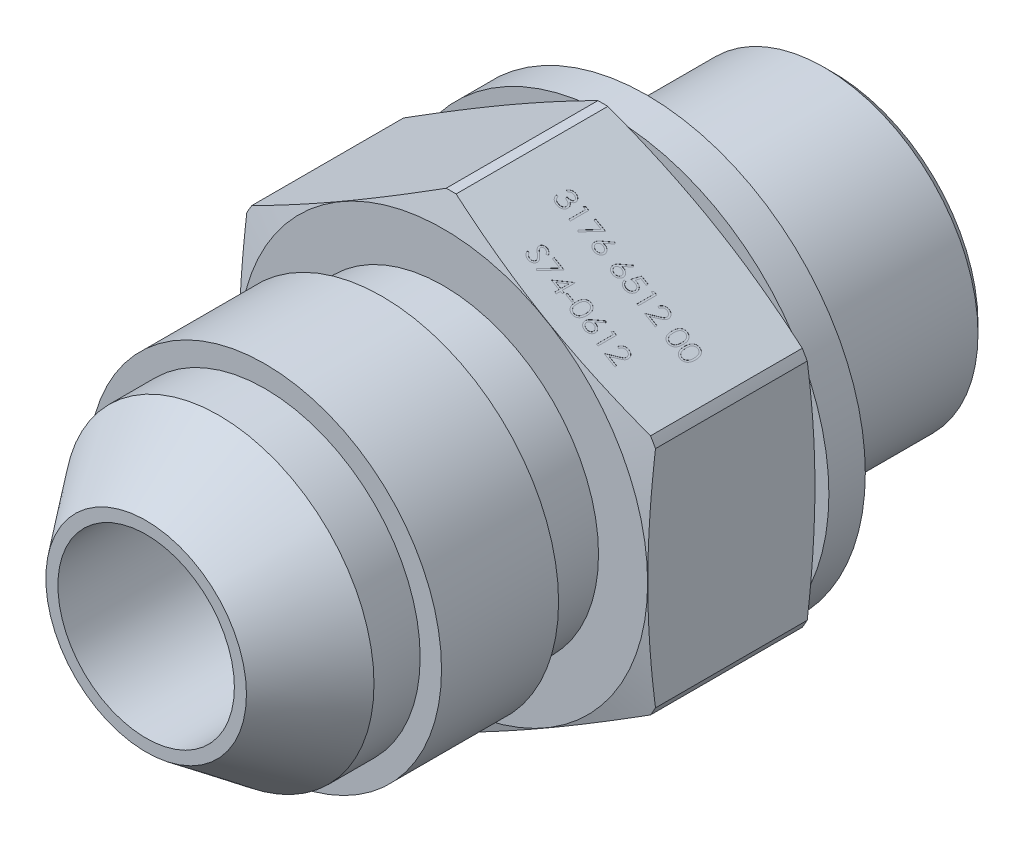
from build123d import *

# Parameters (mm, degrees)
SKETCH2_OUTSIDE_W  = 37.354
SKETCH2_OUTSIDE_H  = 37.354
EXTRUDE2_DEPTH     = 9
SKETCH3_R          = 11.75
SKETCH3_R_2        = 9.9
EXTRUDE3_DEPTH     = 1.96
SKETCH5_W          = 0.384615385
SKETCH5_H          = 0.102564102
CUT_EXTRUDE1_DEPTH = 0.01
SKETCH6_R          = 1.2


with BuildPart() as part:
    # Sketch1 → Revolve1 (revolve)
    with BuildSketch(Plane(origin=(0, 0, 0), x_dir=(0, 0, -1), z_dir=(1, 0, 0)), mode=Mode.PRIVATE) as revolve1_sk:
        Polygon((0, 5.4), (3.914782224, 8.35), (6.4, 8.35), (6.4, 9.5), (12.7, 9.5), (12.7, 8.35), (16, 8.35), (16, 10.99402544), (16.416922127, 12.55), (24.583077873, 12.55), (25, 10.99402544), (25, 8.275), (36.5, 8.275), (37, 7.775), (37, 6.8), (33.449295844, 4.75), (0, 4.75), align=None)
    revolve(revolve1_sk.sketch.rotate(Axis((0, 0, 0), (0, 0, -1)), 90), axis=Axis((0, 0, 0), (0, 0, -1)))

    # Sketch2 outside → Extrude2 (cut)
    with BuildSketch(Plane.XY.offset(-16)):
        Rectangle(SKETCH2_OUTSIDE_W, SKETCH2_OUTSIDE_H)
        Polygon((0, 12.701705922), (-11, 6.350852961), (-11, -6.350852961), (0, -12.701705922), (11, -6.350852961), (11, 6.350852961), align=None, mode=Mode.SUBTRACT)
    extrude(amount=-EXTRUDE2_DEPTH, mode=Mode.SUBTRACT)

    # Sketch3 → Extrude3 (add)
    with BuildSketch(Plane(origin=(0, 0, -25), x_dir=(-1, 0, 0), z_dir=(0, 0, -1))):
        Circle(SKETCH3_R)
        Circle(SKETCH3_R_2, mode=Mode.SUBTRACT)
    extrude(amount=EXTRUDE3_DEPTH)

    # Sketch5 → Cut-Extrude1 (cut)
    # profile 1 of 18: a face of its own
    with BuildSketch(Plane(origin=(5.5, 9.526279442, 0), x_dir=(0.8660254037844386, -0.5000000000000001, 0), z_dir=(0.5000000000000001, 0.8660254037844386, 0))):
        with BuildLine():
            Line((-3.906151243, 20.578724892), (-3.995894833, 20.578724892))
            add(Edge.make_bspline(
                [(-3.995894833, 20.578724892), (-3.993463533, 20.588791316), (-3.98871054, 20.608470352), (-3.978796947, 20.636586712), (-3.96799716, 20.663193432), (-3.955028845, 20.68779231), (-3.940883486, 20.710877711), (-3.924676994, 20.731926033), (-3.907157074, 20.751472594), (-3.887778517, 20.768819233), (-3.867456042, 20.784527156), (-3.845903293, 20.79792003), (-3.823553895, 20.809441216), (-3.800253, 20.818932711), (-3.775931237, 20.826082861), (-3.750808487, 20.831270519), (-3.724818916, 20.834639409), (-3.707176747, 20.834968198), (-3.698218551, 20.835135149)],
                knots=[0, 0, 0, 0, 1.162005537, 2.271625781, 3.343758855, 4.383309926, 5.390229558, 6.379919256, 7.361854164, 8.333198761, 9.295911338, 10.242430842, 11.177959212, 12.116337295, 13.062827104, 14.020064771, 14.994644689, 16, 16, 16, 16], degree=3))
            add(Edge.make_bspline(
                [(-3.698218551, 20.835135149), (-3.685166339, 20.834741083), (-3.659346622, 20.833961547), (-3.621414322, 20.826843136), (-3.584835231, 20.815578813), (-3.550009732, 20.800014891), (-3.517661608, 20.780818516), (-3.488879841, 20.757971448), (-3.464054552, 20.731914505), (-3.443227587, 20.703133772), (-3.426920444, 20.672375055), (-3.414895766, 20.640717867), (-3.407575286, 20.608237304), (-3.406626555, 20.586306653), (-3.406151243, 20.575319443)],
                knots=[0, 0, 0, 0, 1.083050992, 2.142477498, 3.193116406, 4.255571735, 5.30263384, 6.308962982, 7.297363603, 8.282367274, 9.249857812, 10.179914175, 11.08814088, 12, 12, 12, 12], degree=3))
            add(Edge.make_bspline(
                [(-3.406151243, 20.575319443), (-3.406483698, 20.564746073), (-3.40713426, 20.544055629), (-3.412658176, 20.513849487), (-3.421954251, 20.485380459), (-3.434831326, 20.458528698), (-3.45150034, 20.433464458), (-3.471692539, 20.410131346), (-3.495550443, 20.388425873), (-3.513630139, 20.375991738), (-3.522938102, 20.369590277)],
                knots=[0, 0, 0, 0, 1.024540389, 2.004866551, 2.965041327, 3.920577974, 4.882998113, 5.874504559, 6.905732034, 8, 8, 8, 8], degree=3))
            add(Edge.make_bspline(
                [(-3.522938102, 20.369590277), (-3.512300458, 20.364453656), (-3.491224208, 20.354276526), (-3.462495486, 20.334317738), (-3.436416093, 20.311273067), (-3.421872173, 20.293289452), (-3.414564705, 20.284253738)],
                knots=[0, 0, 0, 0, 1.015518401, 2.012035669, 3.001164323, 4, 4, 4, 4], degree=3))
            add(Edge.make_bspline(
                [(-3.414564705, 20.284253738), (-3.409752893, 20.277665809), (-3.400208065, 20.264597833), (-3.388426484, 20.243587426), (-3.377738166, 20.222344143), (-3.369409532, 20.200298598), (-3.362959856, 20.177706309), (-3.358349561, 20.154528481), (-3.35548552, 20.130746189), (-3.355075363, 20.114656909), (-3.354869192, 20.106569443)],
                knots=[0, 0, 0, 0, 1.025084078, 2.033381695, 3.024893161, 4.013698104, 4.991890475, 5.976764909, 6.982997093, 8, 8, 8, 8], degree=3))
            add(Edge.make_bspline(
                [(-3.354869192, 20.106569443), (-3.35538191, 20.092566666), (-3.356404934, 20.064627008), (-3.365548955, 20.023348516), (-3.379724166, 19.982998373), (-3.39985472, 19.944405562), (-3.424388294, 19.908296881), (-3.4535761, 19.875989364), (-3.487086503, 19.848218335), (-3.524459545, 19.825015412), (-3.564950154, 19.806467435), (-3.608257466, 19.793593879), (-3.653757481, 19.785209308), (-3.684959566, 19.784310203), (-3.700822718, 19.783853097)],
                knots=[0, 0, 0, 0, 0.955779014, 1.907060117, 2.875433937, 3.871313158, 4.872415639, 5.851225146, 6.836215519, 7.83643374, 8.849228613, 9.86973379, 10.916971861, 12, 12, 12, 12], degree=3))
            add(Edge.make_bspline(
                [(-3.700822718, 19.783853097), (-3.711513946, 19.784101158), (-3.732550719, 19.784589259), (-3.763477433, 19.787926003), (-3.792997919, 19.79402029), (-3.821152089, 19.802221234), (-3.847964957, 19.812618875), (-3.873354701, 19.825567074), (-3.897477528, 19.840798932), (-3.9201058, 19.858494243), (-3.941236819, 19.878288911), (-3.960309026, 19.900534343), (-3.977640395, 19.924819315), (-3.992766864, 19.951425903), (-4.006377421, 19.980010262), (-4.017571981, 20.010938404), (-4.027425, 20.043933839), (-4.03200599, 20.066927479), (-4.034356372, 20.078724892)],
                knots=[0, 0, 0, 0, 1.048658725, 2.063410685, 3.046034179, 4.001477787, 4.936774919, 5.862367409, 6.792675028, 7.730719943, 8.675894397, 9.627829632, 10.600096036, 11.597688215, 12.626045268, 13.701542398, 14.82072376, 16, 16, 16, 16], degree=3))
            Line((-4.034356372, 20.078724892), (-3.944612782, 20.078724892))
            add(Edge.make_bspline(
                [(-3.944612782, 20.078724892), (-3.942274699, 20.071025174), (-3.937726923, 20.056048554), (-3.929985695, 20.034494181), (-3.921166189, 20.014734737), (-3.911704887, 19.996625273), (-3.901768188, 19.979987444), (-3.890649638, 19.965261196), (-3.879172739, 19.951799709), (-3.870521495, 19.944215535), (-3.866287461, 19.940503738)],
                knots=[0, 0, 0, 0, 1.198163088, 2.33053128, 3.407730985, 4.417276592, 5.372219308, 6.28897303, 7.162600585, 8, 8, 8, 8], degree=3))
            add(Edge.make_bspline(
                [(-3.866287461, 19.940503738), (-3.860688439, 19.936187071), (-3.849507679, 19.927567062), (-3.831288184, 19.916566597), (-3.812126788, 19.907034876), (-3.79160831, 19.89975382), (-3.770175518, 19.893588774), (-3.747481985, 19.88955434), (-3.723727923, 19.886786291), (-3.707508562, 19.886542025), (-3.699220154, 19.8864172)],
                knots=[0, 0, 0, 0, 0.946170439, 1.889420265, 2.845303464, 3.807233317, 4.801018734, 5.828864929, 6.890507805, 8, 8, 8, 8], degree=3))
            add(Edge.make_bspline(
                [(-3.699220154, 19.8864172), (-3.68986201, 19.886593173), (-3.671562968, 19.886937273), (-3.64486158, 19.89010176), (-3.619459452, 19.89471045), (-3.595638616, 19.901828445), (-3.573087042, 19.910622974), (-3.552120857, 19.921665375), (-3.532464826, 19.93462101), (-3.51437071, 19.949346484), (-3.498100565, 19.965466911), (-3.48377499, 19.982327789), (-3.471596516, 19.999858026), (-3.461772636, 20.018154632), (-3.454015336, 20.03714184), (-3.448734422, 20.056872934), (-3.44506256, 20.077186439), (-3.444763528, 20.090994716), (-3.444612782, 20.097955661)],
                knots=[0, 0, 0, 0, 1.217147791, 2.380027433, 3.494444702, 4.572153297, 5.609568379, 6.639424714, 7.649109417, 8.668170816, 9.669597737, 10.625200337, 11.543417969, 12.441394052, 13.322311151, 14.205496177, 15.095365482, 16, 16, 16, 16], degree=3))
            add(Edge.make_bspline(
                [(-3.444612782, 20.097955661), (-3.445050011, 20.107273187), (-3.445922293, 20.125861875), (-3.452581887, 20.153209753), (-3.463535849, 20.1795593), (-3.478870852, 20.204460954), (-3.497538203, 20.227539783), (-3.519356748, 20.248131635), (-3.54450767, 20.26512309), (-3.567656204, 20.276862706), (-3.588160534, 20.284873299), (-3.605707787, 20.290209003), (-3.625352531, 20.29472719), (-3.646857202, 20.298930696), (-3.670383835, 20.302508224), (-3.695906818, 20.3054916), (-3.723431321, 20.307878755), (-3.74248594, 20.308944782), (-3.752305089, 20.309494123)],
                knots=[0, 0, 0, 0, 1.07054697, 2.135767047, 3.216561865, 4.33974944, 5.486079747, 6.621378074, 7.775625952, 8.963672916, 9.598146892, 10.304877434, 11.070270905, 11.915000392, 12.823868403, 13.805723172, 14.86925407, 16, 16, 16, 16], degree=3))
            Line((-3.752305089, 20.309494123), (-3.752305089, 20.412058225))
            add(Edge.make_bspline(
                [(-3.752305089, 20.412058225), (-3.739933328, 20.412268169), (-3.715700086, 20.412679398), (-3.680301713, 20.417653115), (-3.646452195, 20.424533295), (-3.614901698, 20.435071921), (-3.586144922, 20.447312006), (-3.561196465, 20.461555494), (-3.540405851, 20.47738828), (-3.523874116, 20.49505474), (-3.511437194, 20.514001896), (-3.502343823, 20.533749512), (-3.496972302, 20.554470673), (-3.496255254, 20.568612006), (-3.495894833, 20.575720084)],
                knots=[0, 0, 0, 0, 1.321986639, 2.589447074, 3.816329219, 5.01088745, 6.139805852, 7.153945165, 8.075214402, 8.924034688, 9.728124013, 10.488707548, 11.240355623, 12, 12, 12, 12], degree=3))
            add(Edge.make_bspline(
                [(-3.495894833, 20.575720084), (-3.496013236, 20.580942297), (-3.496248794, 20.591331642), (-3.499219444, 20.606510233), (-3.503683456, 20.621224789), (-3.509820522, 20.635412735), (-3.518034864, 20.64897567), (-3.527865146, 20.662029227), (-3.539570317, 20.674498878), (-3.552983302, 20.686121827), (-3.567386675, 20.697198752), (-3.583172325, 20.706602648), (-3.599864289, 20.714644094), (-3.617481048, 20.721275381), (-3.636079771, 20.726263749), (-3.655573073, 20.729845418), (-3.675998126, 20.732084748), (-3.689932906, 20.732407152), (-3.697016628, 20.732571046)],
                knots=[0, 0, 0, 0, 0.884392785, 1.759457502, 2.611959086, 3.489218968, 4.37281399, 5.2945488, 6.255912374, 7.266815255, 8.301784654, 9.332968512, 10.37626691, 11.440494194, 12.520033166, 13.637162961, 14.798855837, 16, 16, 16, 16], degree=3))
            add(Edge.make_bspline(
                [(-3.697016628, 20.732571046), (-3.708402819, 20.732173514), (-3.730642698, 20.731397041), (-3.762704103, 20.724596181), (-3.792509627, 20.7137453), (-3.815292103, 20.700793008), (-3.832115695, 20.68800717), (-3.844137678, 20.676840774), (-3.855943538, 20.664431396), (-3.866756588, 20.650014717), (-3.87769201, 20.634567063), (-3.887647599, 20.617303154), (-3.897321797, 20.598673327), (-3.903151097, 20.585503145), (-3.906151243, 20.578724892)],
                knots=[0, 0, 0, 0, 1.472543308, 2.876219568, 4.221790263, 5.565193594, 6.249813518, 6.953379497, 7.687249741, 8.463570142, 9.283606569, 10.136032583, 11.040678096, 12, 12, 12, 12], degree=3))
        make_face()
    # profile 2 of 18: a face of its own
    with BuildSketch(Plane(origin=(5.5, 9.526279442, 0), x_dir=(0.8660254037844386, -0.5000000000000001, 0), z_dir=(0.5000000000000001, 0.8660254037844386, 0))):
        Polygon((-3.052585538, 20.809494123), (-2.867689705, 20.809494123), (-2.867689705, 19.809494123), (-2.957433295, 19.809494123), (-2.957433295, 20.70693002), (-3.111279448, 20.70693002), align=None)
    # profile 3 of 18: a face of its own
    with BuildSketch(Plane(origin=(5.5, 9.526279442, 0), x_dir=(0.8660254037844386, -0.5000000000000001, 0), z_dir=(0.5000000000000001, 0.8660254037844386, 0))):
        Polygon((-2.431792269, 20.809494123), (-1.816407654, 20.809494123), (-2.342048679, 19.783853097), (-2.419572718, 19.826521366), (-1.968250602, 20.70693002), (-2.431792269, 20.70693002), align=None)
    # profile 4 of 18: a face of its own
    with BuildSketch(Plane(origin=(5.5, 9.526279442, 0), x_dir=(0.8660254037844386, -0.5000000000000001, 0), z_dir=(0.5000000000000001, 0.8660254037844386, 0))):
        with BuildLine():
            Line((-1.265125602, 20.835135149), (-1.196015025, 20.78084829))
            Line((-1.196015025, 20.78084829), (-1.460237782, 20.376801815))
            add(Edge.make_bspline(
                [(-1.460237782, 20.376801815), (-1.442646274, 20.379605775), (-1.408332049, 20.385075217), (-1.373598935, 20.385977487), (-1.356672077, 20.3864172)],
                knots=[0, 0, 0, 0, 1.025318673, 2, 2, 2, 2], degree=3))
            add(Edge.make_bspline(
                [(-1.356672077, 20.3864172), (-1.346508506, 20.386144025), (-1.32650182, 20.385606289), (-1.297128448, 20.381468046), (-1.268903038, 20.374946585), (-1.241942577, 20.365440226), (-1.216150297, 20.353296696), (-1.191378184, 20.338742733), (-1.168091895, 20.321026825), (-1.145991558, 20.301236837), (-1.125926673, 20.279317699), (-1.108162086, 20.256060174), (-1.093240145, 20.231488494), (-1.081133311, 20.205615104), (-1.071731917, 20.178479887), (-1.064878304, 20.150117561), (-1.060826992, 20.120508569), (-1.060276852, 20.100371948), (-1.059997397, 20.090143161)],
                knots=[0, 0, 0, 0, 1.04369286, 2.054478336, 3.041073146, 4.015093852, 4.984733326, 5.965804835, 6.960378782, 7.985147595, 9.009457201, 10.008161701, 10.986880575, 11.956520048, 12.937015923, 13.931873656, 14.949455224, 16, 16, 16, 16], degree=3))
            add(Edge.make_bspline(
                [(-1.059997397, 20.090143161), (-1.060403999, 20.07614896), (-1.061204094, 20.048611684), (-1.069176607, 20.008504054), (-1.081565077, 19.970294764), (-1.099272942, 19.934593858), (-1.121267909, 19.901450266), (-1.148090078, 19.87208299), (-1.178788218, 19.845891551), (-1.213498731, 19.82398966), (-1.250853864, 19.806103074), (-1.290097292, 19.793255862), (-1.330847905, 19.785346299), (-1.358506365, 19.784354699), (-1.372497397, 19.783853097)],
                knots=[0, 0, 0, 0, 1.031375318, 2.029502543, 3.004789286, 3.987476834, 4.960371455, 5.9300674, 6.912260825, 7.929083631, 8.949397511, 9.960523116, 10.96833055, 12, 12, 12, 12], degree=3))
            add(Edge.make_bspline(
                [(-1.372497397, 19.783853097), (-1.385953597, 19.784289727), (-1.412607974, 19.785154615), (-1.451817344, 19.792859169), (-1.489492492, 19.805346913), (-1.525369457, 19.822550992), (-1.558603918, 19.844281816), (-1.588336957, 19.870442467), (-1.614420321, 19.900473743), (-1.636127356, 19.934370985), (-1.653344137, 19.970796687), (-1.666255544, 20.008778732), (-1.673797328, 20.048178727), (-1.674851201, 20.074887624), (-1.675382013, 20.088340277)],
                knots=[0, 0, 0, 0, 1.012016664, 2.004627821, 2.994792927, 3.992885782, 4.990978636, 5.973936114, 6.964471063, 7.975201453, 8.993600317, 9.990122807, 10.98767138, 12, 12, 12, 12], degree=3))
            add(Edge.make_bspline(
                [(-1.675382013, 20.088340277), (-1.675044457, 20.098638729), (-1.674355233, 20.119666201), (-1.669542835, 20.151513066), (-1.661810037, 20.18409909), (-1.653149966, 20.211743145), (-1.643999792, 20.234389294), (-1.636384781, 20.252647434), (-1.626906496, 20.271436312), (-1.616799816, 20.291400208), (-1.605154996, 20.312024618), (-1.592493382, 20.333654237), (-1.57846491, 20.355945074), (-1.568630578, 20.371071987), (-1.563603166, 20.37880502)],
                knots=[0, 0, 0, 0, 1.173818275, 2.396712641, 3.66331629, 4.989737886, 5.693666774, 6.447286557, 7.243889047, 8.091586357, 8.998013824, 9.943181721, 10.948533338, 12, 12, 12, 12], degree=3))
            Line((-1.563603166, 20.37880502), (-1.265125602, 20.835135149))
        make_face()
        with BuildLine():
            add(Edge.make_bspline(
                [(-1.375502205, 20.283853097), (-1.383119989, 20.283630799), (-1.397999735, 20.283196586), (-1.419830425, 20.280675086), (-1.440491354, 20.275926781), (-1.460256249, 20.269879258), (-1.478755593, 20.261564098), (-1.496123833, 20.251463584), (-1.512428133, 20.239571819), (-1.527497719, 20.226057273), (-1.54116048, 20.211260692), (-1.552926518, 20.195412257), (-1.563075775, 20.178893913), (-1.571327723, 20.161567644), (-1.577753459, 20.143440073), (-1.582401531, 20.124594573), (-1.584988317, 20.104904771), (-1.585418669, 20.091552627), (-1.585638423, 20.084734507)],
                knots=[0, 0, 0, 0, 1.129588631, 2.206414736, 3.251139165, 4.268635594, 5.265702196, 6.250456724, 7.242448911, 8.251968645, 9.246821453, 10.222880186, 11.173611482, 12.116736599, 13.062300278, 14.020270554, 14.989073742, 16, 16, 16, 16], degree=3))
            add(Edge.make_bspline(
                [(-1.585638423, 20.084734507), (-1.585459462, 20.07797737), (-1.585108548, 20.06472763), (-1.581922171, 20.045202151), (-1.577055004, 20.026412177), (-1.569814891, 20.008454577), (-1.561178637, 19.991055629), (-1.549777116, 19.974845548), (-1.537143749, 19.958839813), (-1.522042625, 19.944267964), (-1.50583595, 19.930708929), (-1.48852132, 19.918857428), (-1.470475618, 19.908718521), (-1.451455211, 19.900772493), (-1.431729959, 19.894251268), (-1.411135515, 19.889662274), (-1.389657556, 19.887067838), (-1.375108431, 19.886636926), (-1.367689705, 19.8864172)],
                knots=[0, 0, 0, 0, 0.989467248, 1.94019797, 2.891935182, 3.827694429, 4.772920941, 5.730924762, 6.725747692, 7.756678648, 8.79901574, 9.819492441, 10.826891316, 11.826466727, 12.835195252, 13.867842842, 14.912794438, 16, 16, 16, 16], degree=3))
            add(Edge.make_bspline(
                [(-1.367689705, 19.8864172), (-1.360270991, 19.886636943), (-1.34572189, 19.887067889), (-1.324243758, 19.88966208), (-1.303649953, 19.89425198), (-1.283922379, 19.900769914), (-1.264910542, 19.908728088), (-1.246880621, 19.918794351), (-1.229729737, 19.930781813), (-1.213512423, 19.944244793), (-1.198474155, 19.958922751), (-1.18553779, 19.974702671), (-1.174485437, 19.991186641), (-1.165504241, 20.008386038), (-1.158343872, 20.026423035), (-1.153452024, 20.045199242), (-1.150272227, 20.064728392), (-1.149920408, 20.077977628), (-1.149740987, 20.084734507)],
                knots=[0, 0, 0, 0, 1.087397944, 2.132534446, 3.165364764, 4.174271784, 5.174024072, 6.181601208, 7.194203697, 8.236725232, 9.267838612, 10.269026844, 11.221737037, 12.171628256, 13.107553087, 14.05945871, 15.010357665, 16, 16, 16, 16], degree=3))
            add(Edge.make_bspline(
                [(-1.149740987, 20.084734507), (-1.149898213, 20.091561522), (-1.150206798, 20.104960731), (-1.153697069, 20.124585765), (-1.158537747, 20.143535824), (-1.165847185, 20.161691809), (-1.17534334, 20.178982074), (-1.186910028, 20.19549396), (-1.200290762, 20.21135406), (-1.215747202, 20.226086291), (-1.232572983, 20.239556884), (-1.250463151, 20.251448186), (-1.269179715, 20.261483894), (-1.288703698, 20.269857352), (-1.309258808, 20.275900058), (-1.33051319, 20.280658128), (-1.352738688, 20.283190133), (-1.367817719, 20.283629294), (-1.375502205, 20.283853097)],
                knots=[0, 0, 0, 0, 0.978206639, 1.919901502, 2.851605144, 3.780102724, 4.718870031, 5.675451981, 6.667674623, 7.690630536, 8.733308323, 9.756129687, 10.767539656, 11.776269907, 12.797430371, 13.836405707, 14.897401972, 16, 16, 16, 16], degree=3))
        make_face(mode=Mode.SUBTRACT)
    # profile 5 of 18: a face of its own
    with BuildSketch(Plane(origin=(5.5, 9.526279442, 0), x_dir=(0.8660254037844386, -0.5000000000000001, 0), z_dir=(0.5000000000000001, 0.8660254037844386, 0))):
        with BuildLine():
            Line((-0.111279448, 20.835135149), (-0.042168872, 20.78084829))
            Line((-0.042168872, 20.78084829), (-0.306391628, 20.376801815))
            add(Edge.make_bspline(
                [(-0.306391628, 20.376801815), (-0.28880012, 20.379605775), (-0.254485895, 20.385075217), (-0.219752782, 20.385977487), (-0.202825923, 20.3864172)],
                knots=[0, 0, 0, 0, 1.025318673, 2, 2, 2, 2], degree=3))
            add(Edge.make_bspline(
                [(-0.202825923, 20.3864172), (-0.192662352, 20.386144025), (-0.172655667, 20.385606289), (-0.143282295, 20.381468046), (-0.115056884, 20.374946585), (-0.088096424, 20.365440226), (-0.062304143, 20.353296696), (-0.03753203, 20.338742733), (-0.014245741, 20.321026825), (0.007854596, 20.301236837), (0.027919481, 20.279317699), (0.045684068, 20.256060174), (0.060606008, 20.231488494), (0.072712843, 20.205615104), (0.082114237, 20.178479887), (0.08896785, 20.150117561), (0.093019162, 20.120508569), (0.093569302, 20.100371948), (0.093848757, 20.090143161)],
                knots=[0, 0, 0, 0, 1.04369286, 2.054478336, 3.041073146, 4.015093852, 4.984733326, 5.965804835, 6.960378782, 7.985147595, 9.009457201, 10.008161701, 10.986880575, 11.956520048, 12.937015923, 13.931873656, 14.949455224, 16, 16, 16, 16], degree=3))
            add(Edge.make_bspline(
                [(0.093848757, 20.090143161), (0.093442155, 20.07614896), (0.09264206, 20.048611684), (0.084669547, 20.008504054), (0.072281077, 19.970294764), (0.054573212, 19.934593858), (0.032578245, 19.901450266), (0.005756076, 19.87208299), (-0.024942064, 19.845891551), (-0.059652578, 19.82398966), (-0.09700771, 19.806103074), (-0.136251138, 19.793255862), (-0.177001751, 19.785346299), (-0.204660211, 19.784354699), (-0.218651243, 19.783853097)],
                knots=[0, 0, 0, 0, 1.031375318, 2.029502543, 3.004789286, 3.987476834, 4.960371455, 5.9300674, 6.912260825, 7.929083631, 8.949397511, 9.960523116, 10.96833055, 12, 12, 12, 12], degree=3))
            add(Edge.make_bspline(
                [(-0.218651243, 19.783853097), (-0.232107443, 19.784289727), (-0.25876182, 19.785154615), (-0.29797119, 19.792859169), (-0.335646338, 19.805346913), (-0.371523304, 19.822550992), (-0.404757764, 19.844281816), (-0.434490803, 19.870442467), (-0.460574168, 19.900473743), (-0.482281202, 19.934370985), (-0.499497983, 19.970796687), (-0.51240939, 20.008778732), (-0.519951174, 20.048178727), (-0.521005047, 20.074887624), (-0.521535859, 20.088340277)],
                knots=[0, 0, 0, 0, 1.012016664, 2.004627821, 2.994792927, 3.992885782, 4.990978636, 5.973936114, 6.964471063, 7.975201453, 8.993600317, 9.990122807, 10.98767138, 12, 12, 12, 12], degree=3))
            add(Edge.make_bspline(
                [(-0.521535859, 20.088340277), (-0.521198303, 20.098638729), (-0.520509079, 20.119666201), (-0.515696681, 20.151513066), (-0.507963883, 20.18409909), (-0.499303813, 20.211743145), (-0.490153638, 20.234389294), (-0.482538627, 20.252647434), (-0.473060342, 20.271436312), (-0.462953662, 20.291400208), (-0.451308842, 20.312024618), (-0.438647228, 20.333654237), (-0.424618757, 20.355945074), (-0.414784424, 20.371071987), (-0.409757013, 20.37880502)],
                knots=[0, 0, 0, 0, 1.173818275, 2.396712641, 3.66331629, 4.989737886, 5.693666774, 6.447286557, 7.243889047, 8.091586357, 8.998013824, 9.943181721, 10.948533338, 12, 12, 12, 12], degree=3))
            Line((-0.409757013, 20.37880502), (-0.111279448, 20.835135149))
        make_face()
        with BuildLine():
            add(Edge.make_bspline(
                [(-0.221656051, 20.283853097), (-0.229273835, 20.283630799), (-0.244153581, 20.283196586), (-0.265984271, 20.280675086), (-0.2866452, 20.275926781), (-0.306410095, 20.269879258), (-0.324909439, 20.261564098), (-0.342277679, 20.251463584), (-0.358581979, 20.239571819), (-0.373651565, 20.226057273), (-0.387314326, 20.211260692), (-0.399080364, 20.195412257), (-0.409229621, 20.178893913), (-0.417481569, 20.161567644), (-0.423907305, 20.143440073), (-0.428555377, 20.124594573), (-0.431142163, 20.104904771), (-0.431572515, 20.091552627), (-0.431792269, 20.084734507)],
                knots=[0, 0, 0, 0, 1.129588631, 2.206414736, 3.251139165, 4.268635594, 5.265702196, 6.250456724, 7.242448911, 8.251968645, 9.246821453, 10.222880186, 11.173611482, 12.116736599, 13.062300278, 14.020270554, 14.989073742, 16, 16, 16, 16], degree=3))
            add(Edge.make_bspline(
                [(-0.431792269, 20.084734507), (-0.431613309, 20.07797737), (-0.431262394, 20.06472763), (-0.428076017, 20.045202151), (-0.42320885, 20.026412177), (-0.415968737, 20.008454577), (-0.407332483, 19.991055629), (-0.395930962, 19.974845548), (-0.383297595, 19.958839813), (-0.368196471, 19.944267964), (-0.351989796, 19.930708929), (-0.334675167, 19.918857428), (-0.316629464, 19.908718521), (-0.297609057, 19.900772493), (-0.277883805, 19.894251268), (-0.257289361, 19.889662274), (-0.235811402, 19.887067838), (-0.221262277, 19.886636926), (-0.213843551, 19.8864172)],
                knots=[0, 0, 0, 0, 0.989467248, 1.94019797, 2.891935182, 3.827694429, 4.772920941, 5.730924762, 6.725747692, 7.756678648, 8.79901574, 9.819492441, 10.826891316, 11.826466727, 12.835195252, 13.867842842, 14.912794438, 16, 16, 16, 16], degree=3))
            add(Edge.make_bspline(
                [(-0.213843551, 19.8864172), (-0.206424837, 19.886636943), (-0.191875736, 19.887067889), (-0.170397604, 19.88966208), (-0.149803799, 19.89425198), (-0.130076225, 19.900769914), (-0.111064388, 19.908728088), (-0.093034467, 19.918794351), (-0.075883583, 19.930781813), (-0.059666269, 19.944244793), (-0.044628001, 19.958922751), (-0.031691636, 19.974702671), (-0.020639283, 19.991186641), (-0.011658087, 20.008386038), (-0.004497718, 20.026423035), (0.00039413, 20.045199242), (0.003573926, 20.064728392), (0.003925745, 20.077977628), (0.004105167, 20.084734507)],
                knots=[0, 0, 0, 0, 1.087397944, 2.132534446, 3.165364764, 4.174271784, 5.174024072, 6.181601208, 7.194203697, 8.236725232, 9.267838612, 10.269026844, 11.221737037, 12.171628256, 13.107553087, 14.05945871, 15.010357665, 16, 16, 16, 16], degree=3))
            add(Edge.make_bspline(
                [(0.004105167, 20.084734507), (0.00394794, 20.091561522), (0.003639356, 20.104960731), (0.000149085, 20.124585765), (-0.004691594, 20.143535824), (-0.012001031, 20.161691809), (-0.021497187, 20.178982074), (-0.033063874, 20.19549396), (-0.046444609, 20.21135406), (-0.061901048, 20.226086291), (-0.07872683, 20.239556884), (-0.096616997, 20.251448186), (-0.115333561, 20.261483894), (-0.134857544, 20.269857352), (-0.155412654, 20.275900058), (-0.176667036, 20.280658128), (-0.198892534, 20.283190133), (-0.213971565, 20.283629294), (-0.221656051, 20.283853097)],
                knots=[0, 0, 0, 0, 0.978206639, 1.919901502, 2.851605144, 3.780102724, 4.718870031, 5.675451981, 6.667674623, 7.690630536, 8.733308323, 9.756129687, 10.767539656, 11.776269907, 12.797430371, 13.836405707, 14.897401972, 16, 16, 16, 16], degree=3))
        make_face(mode=Mode.SUBTRACT)
    # profile 6 of 18: a face of its own
    with BuildSketch(Plane(origin=(5.5, 9.526279442, 0), x_dir=(0.8660254037844386, -0.5000000000000001, 0), z_dir=(0.5000000000000001, 0.8660254037844386, 0))):
        with BuildLine():
            Line((0.824617987, 20.809494123), (0.824617987, 20.70693002))
            Line((0.824617987, 20.70693002), (0.484473757, 20.70693002))
            Line((0.484473757, 20.70693002), (0.430587539, 20.443909187))
            add(Edge.make_bspline(
                [(0.430587539, 20.443909187), (0.441174931, 20.446832122), (0.46168633, 20.452494846), (0.491960576, 20.458782209), (0.520701206, 20.462572336), (0.539351312, 20.463089853), (0.548376, 20.463340277)],
                knots=[0, 0, 0, 0, 1.100273476, 2.13160584, 3.095893838, 4, 4, 4, 4], degree=3))
            add(Edge.make_bspline(
                [(0.548376, 20.463340277), (0.559542783, 20.463098581), (0.581499468, 20.462623346), (0.613624881, 20.458059961), (0.644291422, 20.450877128), (0.673434957, 20.440842693), (0.7011094, 20.428011341), (0.727060132, 20.411982786), (0.751676678, 20.393258978), (0.774517419, 20.371731831), (0.79523865, 20.348039941), (0.813457504, 20.322566263), (0.82893253, 20.29555836), (0.84137846, 20.266758186), (0.851316841, 20.236484142), (0.857931697, 20.20441769), (0.862336471, 20.170861084), (0.862828581, 20.147916921), (0.863079526, 20.136216879)],
                knots=[0, 0, 0, 0, 1.052922333, 2.070308379, 3.05430497, 4.020497103, 4.973039431, 5.925935799, 6.892292201, 7.88610001, 8.88166317, 9.857072816, 10.836096531, 11.812156883, 12.81219415, 13.836441305, 14.89672472, 16, 16, 16, 16], degree=3))
            add(Edge.make_bspline(
                [(0.863079526, 20.136216879), (0.862889504, 20.128067673), (0.862512029, 20.111879391), (0.860592433, 20.087838191), (0.856896514, 20.064305953), (0.851934307, 20.041279555), (0.845493616, 20.018802592), (0.837696744, 19.996810727), (0.828155022, 19.975440839), (0.817688914, 19.954490726), (0.805904206, 19.93443401), (0.792824633, 19.915677157), (0.779005921, 19.897938791), (0.764136954, 19.881409153), (0.748079527, 19.866196862), (0.731028108, 19.852211638), (0.713118759, 19.839216973), (0.694074404, 19.827740345), (0.674319409, 19.817179501), (0.65356849, 19.808515633), (0.632294004, 19.800769768), (0.610189754, 19.794595617), (0.587305807, 19.789757744), (0.563604443, 19.786471858), (0.539209966, 19.784078591), (0.522674248, 19.783928774), (0.514321513, 19.783853097)],
                knots=[0, 0, 0, 0, 1.056347294, 2.098418968, 3.122841568, 4.141288669, 5.149314143, 6.15115421, 7.162517403, 8.180376062, 9.185164535, 10.17417709, 11.141909838, 12.097768115, 13.052685741, 14.0056014, 14.954263652, 15.917497458, 16.885230207, 17.854509472, 18.828990115, 19.81800267, 20.826176721, 21.857883937, 22.917946725, 24, 24, 24, 24], degree=3))
            add(Edge.make_bspline(
                [(0.514321513, 19.783853097), (0.504357461, 19.78405048), (0.484754367, 19.784438806), (0.456034205, 19.78850123), (0.42840146, 19.794319492), (0.402078574, 19.803072712), (0.376829642, 19.81404051), (0.35299458, 19.827902274), (0.329964358, 19.843610589), (0.308675205, 19.862147833), (0.288916315, 19.882409456), (0.271228741, 19.904397354), (0.255476291, 19.927748623), (0.24191122, 19.952576667), (0.230340357, 19.978816247), (0.22125036, 20.006565676), (0.213913687, 20.035679963), (0.210809853, 20.055723823), (0.209233372, 20.065904379)],
                knots=[0, 0, 0, 0, 1.0467383, 2.05933395, 3.04377827, 4.011590433, 4.970194871, 5.932262533, 6.905835911, 7.896367577, 8.894135286, 9.877477877, 10.858688626, 11.851381753, 12.8477658, 13.868841284, 14.917554742, 16, 16, 16, 16], degree=3))
            Line((0.209233372, 20.065904379), (0.298976962, 20.065904379))
            add(Edge.make_bspline(
                [(0.298976962, 20.065904379), (0.301185121, 20.05636825), (0.305429326, 20.03803928), (0.314745254, 20.012287468), (0.326135504, 19.989339119), (0.339679604, 19.968890666), (0.355836755, 19.951059524), (0.374273735, 19.935168935), (0.394944513, 19.920833184), (0.417914007, 19.908883822), (0.442146316, 19.898692749), (0.467508376, 19.891906551), (0.493309617, 19.887134867), (0.51076058, 19.886657221), (0.519529846, 19.8864172)],
                knots=[0, 0, 0, 0, 1.136247022, 2.183929868, 3.172523383, 4.106158343, 5.02341133, 5.958108904, 6.928429099, 7.938127109, 8.96079061, 9.975095812, 10.982467395, 12, 12, 12, 12], degree=3))
            add(Edge.make_bspline(
                [(0.519529846, 19.8864172), (0.528089402, 19.886651708), (0.544943237, 19.887113456), (0.56974649, 19.890667459), (0.593693026, 19.896141051), (0.616546556, 19.904332438), (0.638706996, 19.914288072), (0.659613788, 19.927063808), (0.679871753, 19.94176667), (0.698851219, 19.958611422), (0.716233919, 19.977174192), (0.731592811, 19.997024876), (0.744386215, 20.018201118), (0.755167389, 20.040336304), (0.763354045, 20.063673035), (0.769194326, 20.088101942), (0.772623771, 20.113683365), (0.773095537, 20.131131739), (0.773335936, 20.140022969)],
                knots=[0, 0, 0, 0, 1.027316725, 2.022795036, 3.002884548, 3.971462791, 4.93288096, 5.914575861, 6.907176829, 7.935150275, 8.956128384, 9.956726525, 10.942570165, 11.921478529, 12.907843606, 13.90538589, 14.932640048, 16, 16, 16, 16], degree=3))
            add(Edge.make_bspline(
                [(0.773335936, 20.140022969), (0.773147799, 20.148044612), (0.772779548, 20.163745838), (0.769770813, 20.18671704), (0.764537393, 20.208452195), (0.757273427, 20.229056261), (0.748050711, 20.248548674), (0.736780336, 20.266949548), (0.723250793, 20.284016357), (0.707795968, 20.299757087), (0.690865099, 20.314284194), (0.672166887, 20.326668219), (0.652092622, 20.337086481), (0.630884165, 20.346077338), (0.608037051, 20.352534693), (0.584003728, 20.357382661), (0.558524668, 20.36018705), (0.541104472, 20.360576161), (0.532150039, 20.360776174)],
                knots=[0, 0, 0, 0, 1.045622112, 2.046656509, 3.013763289, 3.955457236, 4.890082067, 5.820317437, 6.762574623, 7.722996705, 8.69280354, 9.665887285, 10.63943826, 11.638615906, 12.663482002, 13.728887084, 14.832589034, 16, 16, 16, 16], degree=3))
            add(Edge.make_bspline(
                [(0.532150039, 20.360776174), (0.524398916, 20.360610291), (0.508394815, 20.360267784), (0.483845436, 20.357745928), (0.458047801, 20.353677558), (0.431100802, 20.348081487), (0.402923514, 20.340758323), (0.373575399, 20.331982751), (0.342994752, 20.321490751), (0.322389688, 20.313567262), (0.311797475, 20.309494123)],
                knots=[0, 0, 0, 0, 0.817624296, 1.688186739, 2.600797293, 3.572016777, 4.590301741, 5.671205678, 6.80286297, 8, 8, 8, 8], degree=3))
            Line((0.311797475, 20.309494123), (0.414361577, 20.809494123))
            Line((0.414361577, 20.809494123), (0.824617987, 20.809494123))
        make_face()
    # profile 7 of 18: a face of its own
    with BuildSketch(Plane(origin=(5.5, 9.526279442, 0), x_dir=(0.8660254037844386, -0.5000000000000001, 0), z_dir=(0.5000000000000001, 0.8660254037844386, 0))):
        Polygon((1.178183693, 20.809494123), (1.363079526, 20.809494123), (1.363079526, 19.809494123), (1.273335936, 19.809494123), (1.273335936, 20.70693002), (1.119489782, 20.70693002), align=None)
    # profile 8 of 18: a face of its own
    with BuildSketch(Plane(origin=(5.5, 9.526279442, 0), x_dir=(0.8660254037844386, -0.5000000000000001, 0), z_dir=(0.5000000000000001, 0.8660254037844386, 0))):
        with BuildLine():
            Line((1.863079526, 20.501801815), (1.773335936, 20.501801815))
            add(Edge.make_bspline(
                [(1.773335936, 20.501801815), (1.773920837, 20.513707783), (1.775069567, 20.537090787), (1.780449078, 20.571183332), (1.788146471, 20.603770417), (1.799029744, 20.634590393), (1.812545823, 20.663915766), (1.828754403, 20.691630056), (1.847952646, 20.717627539), (1.869725998, 20.741667208), (1.893374181, 20.7637208), (1.918890164, 20.782765155), (1.945703028, 20.798855918), (1.973731428, 20.812307702), (2.003291589, 20.822404801), (2.034115263, 20.829896698), (2.066337873, 20.834404225), (2.088292165, 20.834888735), (2.099457731, 20.835135149)],
                knots=[0, 0, 0, 0, 1.10065271, 2.161652631, 3.183658789, 4.190468796, 5.17591951, 6.163126047, 7.15150782, 8.156236427, 9.156009102, 10.134482811, 11.092018607, 12.041330605, 13.001268258, 13.972401359, 14.968799086, 16, 16, 16, 16], degree=3))
            add(Edge.make_bspline(
                [(2.099457731, 20.835135149), (2.110422895, 20.834878447), (2.131969051, 20.834374037), (2.163415341, 20.830042314), (2.19335171, 20.823257859), (2.221719644, 20.813739169), (2.248292805, 20.800943618), (2.273270818, 20.785572893), (2.296951049, 20.767795798), (2.318267273, 20.746866137), (2.33784101, 20.724522599), (2.354727369, 20.700668912), (2.369188273, 20.676031973), (2.381241895, 20.650423916), (2.390115078, 20.623603622), (2.396851709, 20.595961564), (2.400659541, 20.567211618), (2.401243948, 20.547752602), (2.401541064, 20.537859507)],
                knots=[0, 0, 0, 0, 1.111607364, 2.184268762, 3.212621178, 4.221274766, 5.211760367, 6.196651075, 7.1921475, 8.207485113, 9.220403448, 10.201281604, 11.166441695, 12.114753415, 13.065576456, 14.026450734, 14.996634279, 16, 16, 16, 16], degree=3))
            add(Edge.make_bspline(
                [(2.401541064, 20.537859507), (2.401057275, 20.523931555), (2.400098186, 20.496320065), (2.391894078, 20.45574439), (2.37908079, 20.416431985), (2.363652973, 20.384792755), (2.348089418, 20.359297472), (2.334064416, 20.338306413), (2.317645898, 20.315704851), (2.298594899, 20.291568468), (2.277305507, 20.26570821), (2.253584889, 20.238139697), (2.227263894, 20.209147763), (2.208790036, 20.189346162), (2.199217346, 20.179085469)],
                knots=[0, 0, 0, 0, 1.184426356, 2.348067706, 3.509069118, 4.696110526, 5.333549288, 6.050745305, 6.844228056, 7.710549037, 8.667450064, 9.695053472, 10.805634456, 12, 12, 12, 12], degree=3))
            Line((2.199217346, 20.179085469), (1.949017026, 19.912058225))
            Line((1.949017026, 19.912058225), (2.414361577, 19.912058225))
            Line((2.414361577, 19.912058225), (2.414361577, 19.809494123))
            Line((2.414361577, 19.809494123), (1.734874398, 19.809494123))
            Line((1.734874398, 19.809494123), (2.122694911, 20.223356302))
            add(Edge.make_bspline(
                [(2.122694911, 20.223356302), (2.132137164, 20.233212961), (2.1502738, 20.252145586), (2.175925965, 20.279786432), (2.198965676, 20.305429158), (2.219542074, 20.329025315), (2.23720879, 20.350920048), (2.25288657, 20.370404249), (2.265448168, 20.388334092), (2.279081138, 20.409117125), (2.292285133, 20.434492072), (2.30363152, 20.465501698), (2.310550048, 20.49742377), (2.311380001, 20.518995781), (2.311797475, 20.529846687)],
                knots=[0, 0, 0, 0, 1.329631726, 2.553950428, 3.673215718, 4.687767853, 5.603093632, 6.413772471, 7.123043292, 7.734684054, 8.834405432, 9.900288307, 10.943827018, 12, 12, 12, 12], degree=3))
            add(Edge.make_bspline(
                [(2.311797475, 20.529846687), (2.311615834, 20.536669944), (2.311257855, 20.550117272), (2.308098513, 20.569833203), (2.303324083, 20.588851722), (2.29648258, 20.607231327), (2.287452083, 20.624787228), (2.276459689, 20.641540794), (2.263776814, 20.657737641), (2.249105022, 20.672924297), (2.232987445, 20.686833213), (2.215960517, 20.69915438), (2.197946201, 20.709451269), (2.179020452, 20.717892268), (2.159236032, 20.724513806), (2.138554677, 20.729101971), (2.117033529, 20.731982681), (2.102338245, 20.732372445), (2.094850359, 20.732571046)],
                knots=[0, 0, 0, 0, 0.991446411, 1.95395049, 2.89581595, 3.838931463, 4.798493298, 5.75982156, 6.748411868, 7.785213223, 8.824556874, 9.840280684, 10.836137867, 11.835679398, 12.848801643, 13.863922112, 14.911575587, 16, 16, 16, 16], degree=3))
            add(Edge.make_bspline(
                [(2.094850359, 20.732571046), (2.087030121, 20.732366751), (2.071672465, 20.73196555), (2.04912417, 20.729159074), (2.027613948, 20.724317405), (2.00708769, 20.717695498), (1.987510665, 20.70927877), (1.968978081, 20.698795415), (1.951531542, 20.686285845), (1.935138249, 20.672102829), (1.920034255, 20.656312086), (1.906763719, 20.638709239), (1.895168287, 20.619615692), (1.885051363, 20.599082963), (1.876835451, 20.57692474), (1.870557408, 20.553219682), (1.865589738, 20.528070716), (1.863930161, 20.510703549), (1.863079526, 20.501801815)],
                knots=[0, 0, 0, 0, 1.031018746, 2.02475058, 2.990194455, 3.934040569, 4.864654155, 5.795059489, 6.735614925, 7.690564532, 8.649604399, 9.611025574, 10.590972636, 11.591080095, 12.624614302, 13.701020113, 14.821632451, 16, 16, 16, 16], degree=3))
        make_face()
    # profile 9 of 18: a face of its own
    with BuildSketch(Plane(origin=(5.5, 9.526279442, 0), x_dir=(0.8660254037844386, -0.5000000000000001, 0), z_dir=(0.5000000000000001, 0.8660254037844386, 0))):
        with BuildLine():
            add(Edge.make_bspline(
                [(2.888720552, 20.309093482), (2.888814271, 20.325121307), (2.888996322, 20.356255588), (2.891021586, 20.401622629), (2.894385969, 20.444182711), (2.898996647, 20.483937873), (2.904607499, 20.520898377), (2.912097638, 20.554965451), (2.920615581, 20.586296767), (2.930487709, 20.614994495), (2.941627077, 20.641445267), (2.953751151, 20.666138182), (2.967341093, 20.689035877), (2.981620211, 20.710503817), (2.997166517, 20.730190587), (3.0135376, 20.748374205), (3.031372422, 20.764634419), (3.05006471, 20.779447648), (3.069783699, 20.792433212), (3.089967318, 20.803871137), (3.110754491, 20.813642528), (3.132201972, 20.821325509), (3.154116989, 20.827671466), (3.176576151, 20.832011165), (3.19961654, 20.83474171), (3.215168379, 20.835002758), (3.223055487, 20.835135149)],
                knots=[0, 0, 0, 0, 1.646270934, 3.197905019, 4.663502075, 6.030701355, 7.308322542, 8.50163776, 9.611534131, 10.641858119, 11.616356847, 12.558055219, 13.465016945, 14.349605745, 15.204443733, 16.039544428, 16.859896111, 17.680448484, 18.487036065, 19.28249412, 20.06191084, 20.843045899, 21.620316918, 22.403196591, 23.190181807, 24, 24, 24, 24], degree=3))
            add(Edge.make_bspline(
                [(3.223055487, 20.835135149), (3.231008481, 20.834995773), (3.246824484, 20.834718598), (3.270207448, 20.832054615), (3.293050214, 20.827634294), (3.315255397, 20.821371158), (3.337005393, 20.813600965), (3.358130081, 20.803861788), (3.378760676, 20.792524969), (3.398569329, 20.779203861), (3.417773505, 20.764351783), (3.435901494, 20.747562449), (3.452954948, 20.729005386), (3.469147892, 20.708879139), (3.48402092, 20.686797686), (3.498184758, 20.663145084), (3.510862482, 20.637507694), (3.523072389, 20.610313274), (3.533611528, 20.580809372), (3.54311617, 20.549162297), (3.550795875, 20.514998244), (3.55719281, 20.478496459), (3.562148495, 20.439522893), (3.565757821, 20.398161088), (3.567664417, 20.354383834), (3.568023474, 20.32445302), (3.568207731, 20.309093482)],
                knots=[0, 0, 0, 0, 0.810914788, 1.612654377, 2.396697861, 3.181598691, 3.963628158, 4.749916497, 5.551656086, 6.361998678, 7.18212741, 8.025565596, 8.878627764, 9.750805457, 10.657531673, 11.591944965, 12.560506719, 13.57287815, 14.630710178, 15.753379473, 16.941251878, 18.199788006, 19.531962791, 20.947069417, 22.433333509, 24, 24, 24, 24], degree=3))
            add(Edge.make_bspline(
                [(3.568207731, 20.309093482), (3.568021564, 20.293800937), (3.567658825, 20.264004036), (3.565779195, 20.220423758), (3.562076729, 20.179281459), (3.557445303, 20.14047847), (3.551030743, 20.104176293), (3.543143552, 20.070249308), (3.534386317, 20.038551002), (3.523576376, 20.009341056), (3.511744744, 19.982211992), (3.498871831, 19.956878521), (3.485080452, 19.933116723), (3.470055097, 19.911116795), (3.454039836, 19.890722893), (3.436691896, 19.872295001), (3.4185003, 19.855389095), (3.39923961, 19.840345773), (3.379122024, 19.827178686), (3.358562288, 19.8154033), (3.337195607, 19.805908244), (3.315506192, 19.797755375), (3.293183801, 19.791526675), (3.270256261, 19.787219859), (3.246840194, 19.784199331), (3.231011175, 19.783968908), (3.223055487, 19.783853097)],
                knots=[0, 0, 0, 0, 1.561518951, 3.042555995, 4.452378317, 5.7783523, 7.031515105, 8.214008947, 9.334062868, 10.386615937, 11.391082383, 12.354592575, 13.286541444, 14.194233754, 15.072674879, 15.931287219, 16.775624067, 17.606195743, 18.42308326, 19.229000347, 20.022332153, 20.807536673, 21.593273796, 22.3848459, 23.188221202, 24, 24, 24, 24], degree=3))
            add(Edge.make_bspline(
                [(3.223055487, 19.783853097), (3.215168598, 19.783986342), (3.199617191, 19.784249074), (3.176573641, 19.786967283), (3.154207228, 19.791337426), (3.132407584, 19.797456456), (3.111062866, 19.804946409), (3.090463926, 19.814704605), (3.070381731, 19.82594291), (3.050869858, 19.838741602), (3.032294955, 19.85340494), (3.014552496, 19.869623308), (2.998088205, 19.887801426), (2.982764178, 19.907652261), (2.968200152, 19.928993187), (2.954803189, 19.95211558), (2.942411516, 19.976927754), (2.931084804, 20.003590014), (2.921042329, 20.032491422), (2.912171555, 20.063962616), (2.90516751, 20.098281369), (2.89917238, 20.135172045), (2.894336842, 20.174793168), (2.891035607, 20.217166248), (2.888995231, 20.262264879), (2.888813782, 20.2931991), (2.888720552, 20.309093482)],
                knots=[0, 0, 0, 0, 0.810891512, 1.598919785, 2.382837074, 3.152667961, 3.926044502, 4.706494248, 5.493654104, 6.291793342, 7.103789334, 7.925228297, 8.761435821, 9.622817696, 10.50288917, 11.416980706, 12.369136599, 13.353924996, 14.394355917, 15.514179734, 16.714354668, 17.994756427, 19.357759367, 20.818452758, 22.365282078, 24, 24, 24, 24], degree=3))
        make_face()
        with BuildLine():
            add(Edge.make_bspline(
                [(2.978464141, 20.309494123), (2.978498269, 20.296137352), (2.978564504, 20.270214482), (2.980294847, 20.232544979), (2.982652056, 20.197410599), (2.985692427, 20.164766731), (2.990207555, 20.134723871), (2.995266637, 20.10707539), (3.001423234, 20.081967608), (3.008707525, 20.059228233), (3.01700441, 20.038471357), (3.026063228, 20.019156724), (3.035794863, 20.001056171), (3.046686049, 19.984332282), (3.058547496, 19.968930521), (3.071111284, 19.954578283), (3.084846308, 19.941779146), (3.103847378, 19.926428616), (3.128932085, 19.910566006), (3.160537929, 19.896752838), (3.193014629, 19.888072136), (3.215057844, 19.886968206), (3.226060295, 19.8864172)],
                knots=[0, 0, 0, 0, 1.459021318, 2.831673884, 4.118529203, 5.306027144, 6.411944654, 7.436330062, 8.375795394, 9.233974572, 10.042671642, 10.816086306, 11.563610507, 12.285937304, 12.993564865, 13.685989202, 14.367179055, 15.041617293, 16.353048772, 17.594441528, 18.799311195, 20, 20, 20, 20], degree=3))
            add(Edge.make_bspline(
                [(3.226060295, 19.8864172), (3.237133916, 19.886873709), (3.259258294, 19.887785784), (3.291582235, 19.896585423), (3.322962312, 19.909862434), (3.347554295, 19.925561721), (3.366263593, 19.940512673), (3.379668448, 19.953259715), (3.39197189, 19.96753282), (3.403641054, 19.982932619), (3.414343647, 19.999753329), (3.424075972, 20.017914064), (3.432956929, 20.037465258), (3.438016656, 20.051113755), (3.440603564, 20.058091879)],
                knots=[0, 0, 0, 0, 1.353760809, 2.704726607, 4.075137775, 5.516104923, 6.260822281, 7.007110065, 7.778089737, 8.566572457, 9.372053459, 10.217411131, 11.088608312, 12, 12, 12, 12], degree=3))
            add(Edge.make_bspline(
                [(3.440603564, 20.058091879), (3.443618355, 20.067014662), (3.449739673, 20.085131737), (3.457628752, 20.113235638), (3.463841723, 20.142722142), (3.469431256, 20.173415033), (3.473246415, 20.205540661), (3.476317219, 20.238999628), (3.478125986, 20.27381716), (3.478350201, 20.297472872), (3.478464141, 20.309494123)],
                knots=[0, 0, 0, 0, 0.884706709, 1.796334032, 2.740027952, 3.714592787, 4.726048262, 5.777819803, 6.87074269, 8, 8, 8, 8], degree=3))
            add(Edge.make_bspline(
                [(3.478464141, 20.309494123), (3.478306944, 20.321513429), (3.477999434, 20.345025762), (3.476824009, 20.379459528), (3.473788702, 20.412164603), (3.470417525, 20.44328188), (3.46544689, 20.47263911), (3.460087517, 20.500482054), (3.45288717, 20.526465776), (3.445195806, 20.550997085), (3.436392836, 20.573797272), (3.426702626, 20.594972639), (3.416353552, 20.614625418), (3.405112912, 20.632701687), (3.393114145, 20.649282413), (3.38004056, 20.664035155), (3.366410739, 20.677417145), (3.347320115, 20.692692165), (3.32232746, 20.708266935), (3.291228704, 20.72260001), (3.258865663, 20.73083095), (3.236987533, 20.731991432), (3.226060295, 20.732571046)],
                knots=[0, 0, 0, 0, 1.31362396, 2.569729283, 3.763502607, 4.902122613, 5.988968491, 7.01645872, 7.998833611, 8.933434873, 9.825090667, 10.667526885, 11.477055099, 12.250526234, 12.991942729, 13.710640831, 14.402115721, 15.076753259, 16.378508321, 17.609869233, 18.806226677, 20, 20, 20, 20], degree=3))
            add(Edge.make_bspline(
                [(3.226060295, 20.732571046), (3.215000126, 20.731990633), (3.192859639, 20.730828749), (3.160160223, 20.722630676), (3.128816123, 20.708341257), (3.103889558, 20.692640579), (3.084785619, 20.677686776), (3.071333421, 20.664719218), (3.058720229, 20.650534574), (3.047100886, 20.63499117), (3.036218234, 20.618286779), (3.026223659, 20.600289989), (3.017218708, 20.580909599), (3.00890884, 20.560162046), (3.001602329, 20.537424634), (2.995575483, 20.512347778), (2.990007753, 20.484787238), (2.986066248, 20.454581664), (2.982562318, 20.42192962), (2.980310504, 20.386707529), (2.978558716, 20.348974849), (2.978496298, 20.322917947), (2.978464141, 20.309494123)],
                knots=[0, 0, 0, 0, 1.207732386, 2.417664972, 3.655092373, 4.956220595, 5.625982001, 6.301752483, 6.994047911, 7.697131622, 8.419323945, 9.170223765, 9.943494443, 10.752040957, 11.610060368, 12.549350801, 13.567764191, 14.679664412, 15.874934091, 17.154273443, 18.533957287, 20, 20, 20, 20], degree=3))
        make_face(mode=Mode.SUBTRACT)
    # profile 10 of 18: a face of its own
    with BuildSketch(Plane(origin=(5.5, 9.526279442, 0), x_dir=(0.8660254037844386, -0.5000000000000001, 0), z_dir=(0.5000000000000001, 0.8660254037844386, 0))):
        with BuildLine():
            add(Edge.make_bspline(
                [(3.657951321, 20.309093482), (3.65804504, 20.325121307), (3.658227092, 20.356255588), (3.660252355, 20.401622629), (3.663616738, 20.444182711), (3.668227416, 20.483937873), (3.673838268, 20.520898377), (3.681328407, 20.554965451), (3.68984635, 20.586296767), (3.699718478, 20.614994495), (3.710857846, 20.641445267), (3.722981921, 20.666138182), (3.736571862, 20.689035877), (3.75085098, 20.710503817), (3.766397286, 20.730190587), (3.782768369, 20.748374205), (3.800603191, 20.764634419), (3.819295479, 20.779447648), (3.839014469, 20.792433212), (3.859198088, 20.803871137), (3.879985261, 20.813642528), (3.901432742, 20.821325509), (3.923347758, 20.827671466), (3.94580692, 20.832011165), (3.96884731, 20.83474171), (3.984399148, 20.835002758), (3.992286257, 20.835135149)],
                knots=[0, 0, 0, 0, 1.646270934, 3.197905019, 4.663502075, 6.030701355, 7.308322542, 8.50163776, 9.611534131, 10.641858119, 11.616356847, 12.558055219, 13.465016945, 14.349605745, 15.204443733, 16.039544428, 16.859896111, 17.680448484, 18.487036065, 19.28249412, 20.06191084, 20.843045899, 21.620316918, 22.403196591, 23.190181807, 24, 24, 24, 24], degree=3))
            add(Edge.make_bspline(
                [(3.992286257, 20.835135149), (4.000239251, 20.834995773), (4.016055253, 20.834718598), (4.039438217, 20.832054615), (4.062280984, 20.827634294), (4.084486166, 20.821371158), (4.106236162, 20.813600965), (4.12736085, 20.803861788), (4.147991445, 20.792524969), (4.167800098, 20.779203861), (4.187004274, 20.764351783), (4.205132264, 20.747562449), (4.222185717, 20.729005386), (4.238378661, 20.708879139), (4.253251689, 20.686797686), (4.267415527, 20.663145084), (4.280093251, 20.637507694), (4.292303159, 20.610313274), (4.302842298, 20.580809372), (4.312346939, 20.549162297), (4.320026644, 20.514998244), (4.326423579, 20.478496459), (4.331379264, 20.439522893), (4.33498859, 20.398161088), (4.336895186, 20.354383834), (4.337254243, 20.32445302), (4.3374385, 20.309093482)],
                knots=[0, 0, 0, 0, 0.810914788, 1.612654377, 2.396697861, 3.181598691, 3.963628158, 4.749916497, 5.551656086, 6.361998678, 7.18212741, 8.025565596, 8.878627764, 9.750805457, 10.657531673, 11.591944965, 12.560506719, 13.57287815, 14.630710178, 15.753379473, 16.941251878, 18.199788006, 19.531962791, 20.947069417, 22.433333509, 24, 24, 24, 24], degree=3))
            add(Edge.make_bspline(
                [(4.3374385, 20.309093482), (4.337252333, 20.293800937), (4.336889594, 20.264004036), (4.335009964, 20.220423758), (4.331307498, 20.179281459), (4.326676073, 20.14047847), (4.320261512, 20.104176293), (4.312374321, 20.070249308), (4.303617086, 20.038551002), (4.292807145, 20.009341056), (4.280975514, 19.982211992), (4.2681026, 19.956878521), (4.254311222, 19.933116723), (4.239285866, 19.911116795), (4.223270605, 19.890722893), (4.205922665, 19.872295001), (4.18773107, 19.855389095), (4.168470379, 19.840345773), (4.148352793, 19.827178686), (4.127793057, 19.8154033), (4.106426376, 19.805908244), (4.084736961, 19.797755375), (4.062414571, 19.791526675), (4.03948703, 19.787219859), (4.016070963, 19.784199331), (4.000241944, 19.783968908), (3.992286257, 19.783853097)],
                knots=[0, 0, 0, 0, 1.561518951, 3.042555995, 4.452378317, 5.7783523, 7.031515105, 8.214008947, 9.334062868, 10.386615937, 11.391082383, 12.354592575, 13.286541444, 14.194233754, 15.072674879, 15.931287219, 16.775624067, 17.606195743, 18.42308326, 19.229000347, 20.022332153, 20.807536673, 21.593273796, 22.3848459, 23.188221202, 24, 24, 24, 24], degree=3))
            add(Edge.make_bspline(
                [(3.992286257, 19.783853097), (3.984399367, 19.783986342), (3.96884796, 19.784249074), (3.94580441, 19.786967283), (3.923437997, 19.791337426), (3.901638353, 19.797456456), (3.880293635, 19.804946409), (3.859694696, 19.814704605), (3.8396125, 19.82594291), (3.820100627, 19.838741602), (3.801525724, 19.85340494), (3.783783265, 19.869623308), (3.767318974, 19.887801426), (3.751994947, 19.907652261), (3.737430922, 19.928993187), (3.724033958, 19.95211558), (3.711642285, 19.976927754), (3.700315574, 20.003590014), (3.690273098, 20.032491422), (3.681402325, 20.063962616), (3.67439828, 20.098281369), (3.66840315, 20.135172045), (3.663567612, 20.174793168), (3.660266376, 20.217166248), (3.658226, 20.262264879), (3.658044551, 20.2931991), (3.657951321, 20.309093482)],
                knots=[0, 0, 0, 0, 0.810891512, 1.598919785, 2.382837074, 3.152667961, 3.926044502, 4.706494248, 5.493654104, 6.291793342, 7.103789334, 7.925228297, 8.761435821, 9.622817696, 10.50288917, 11.416980706, 12.369136599, 13.353924996, 14.394355917, 15.514179734, 16.714354668, 17.994756427, 19.357759367, 20.818452758, 22.365282078, 24, 24, 24, 24], degree=3))
        make_face()
        with BuildLine():
            add(Edge.make_bspline(
                [(3.747694911, 20.309494123), (3.747729038, 20.296137352), (3.747795274, 20.270214482), (3.749525617, 20.232544979), (3.751882826, 20.197410599), (3.754923196, 20.164766731), (3.759438324, 20.134723871), (3.764497407, 20.10707539), (3.770654004, 20.081967608), (3.777938295, 20.059228233), (3.786235179, 20.038471357), (3.795293998, 20.019156724), (3.805025633, 20.001056171), (3.815916819, 19.984332282), (3.827778265, 19.968930521), (3.840342053, 19.954578283), (3.854077078, 19.941779146), (3.873078147, 19.926428616), (3.898162854, 19.910566006), (3.929768698, 19.896752838), (3.962245398, 19.888072136), (3.984288613, 19.886968206), (3.995291064, 19.8864172)],
                knots=[0, 0, 0, 0, 1.459021318, 2.831673884, 4.118529203, 5.306027144, 6.411944654, 7.436330062, 8.375795394, 9.233974572, 10.042671642, 10.816086306, 11.563610507, 12.285937304, 12.993564865, 13.685989202, 14.367179055, 15.041617293, 16.353048772, 17.594441528, 18.799311195, 20, 20, 20, 20], degree=3))
            add(Edge.make_bspline(
                [(3.995291064, 19.8864172), (4.006364685, 19.886873709), (4.028489063, 19.887785784), (4.060813004, 19.896585423), (4.092193082, 19.909862434), (4.116785064, 19.925561721), (4.135494363, 19.940512673), (4.148899217, 19.953259715), (4.161202659, 19.96753282), (4.172871824, 19.982932619), (4.183574417, 19.999753329), (4.193306742, 20.017914064), (4.202187698, 20.037465258), (4.207247426, 20.051113755), (4.209834334, 20.058091879)],
                knots=[0, 0, 0, 0, 1.353760809, 2.704726607, 4.075137775, 5.516104923, 6.260822281, 7.007110065, 7.778089737, 8.566572457, 9.372053459, 10.217411131, 11.088608312, 12, 12, 12, 12], degree=3))
            add(Edge.make_bspline(
                [(4.209834334, 20.058091879), (4.212849124, 20.067014662), (4.218970443, 20.085131737), (4.226859521, 20.113235638), (4.233072492, 20.142722142), (4.238662025, 20.173415033), (4.242477184, 20.205540661), (4.245547988, 20.238999628), (4.247356756, 20.27381716), (4.24758097, 20.297472872), (4.247694911, 20.309494123)],
                knots=[0, 0, 0, 0, 0.884706709, 1.796334032, 2.740027952, 3.714592787, 4.726048262, 5.777819803, 6.87074269, 8, 8, 8, 8], degree=3))
            add(Edge.make_bspline(
                [(4.247694911, 20.309494123), (4.247537714, 20.321513429), (4.247230203, 20.345025762), (4.246054778, 20.379459528), (4.243019471, 20.412164603), (4.239648294, 20.44328188), (4.234677659, 20.47263911), (4.229318286, 20.500482054), (4.22211794, 20.526465776), (4.214426575, 20.550997085), (4.205623605, 20.573797272), (4.195933395, 20.594972639), (4.185584321, 20.614625418), (4.174343681, 20.632701687), (4.162344915, 20.649282413), (4.149271329, 20.664035155), (4.135641508, 20.677417145), (4.116550884, 20.692692165), (4.09155823, 20.708266935), (4.060459473, 20.72260001), (4.028096432, 20.73083095), (4.006218302, 20.731991432), (3.995291064, 20.732571046)],
                knots=[0, 0, 0, 0, 1.31362396, 2.569729283, 3.763502607, 4.902122613, 5.988968491, 7.01645872, 7.998833611, 8.933434873, 9.825090667, 10.667526885, 11.477055099, 12.250526234, 12.991942729, 13.710640831, 14.402115721, 15.076753259, 16.378508321, 17.609869233, 18.806226677, 20, 20, 20, 20], degree=3))
            add(Edge.make_bspline(
                [(3.995291064, 20.732571046), (3.984230895, 20.731990633), (3.962090408, 20.730828749), (3.929390992, 20.722630676), (3.898046892, 20.708341257), (3.873120328, 20.692640579), (3.854016389, 20.677686776), (3.84056419, 20.664719218), (3.827950998, 20.650534574), (3.816331656, 20.63499117), (3.805449003, 20.618286779), (3.795454428, 20.600289989), (3.786449477, 20.580909599), (3.778139609, 20.560162046), (3.770833098, 20.537424634), (3.764806252, 20.512347778), (3.759238522, 20.484787238), (3.755297017, 20.454581664), (3.751793087, 20.42192962), (3.749541273, 20.386707529), (3.747789485, 20.348974849), (3.747727067, 20.322917947), (3.747694911, 20.309494123)],
                knots=[0, 0, 0, 0, 1.207732386, 2.417664972, 3.655092373, 4.956220595, 5.625982001, 6.301752483, 6.994047911, 7.697131622, 8.419323945, 9.170223765, 9.943494443, 10.752040957, 11.610060368, 12.549350801, 13.567764191, 14.679664412, 15.874934091, 17.154273443, 18.533957287, 20, 20, 20, 20], degree=3))
        make_face(mode=Mode.SUBTRACT)
    # profile 11 of 18: a face of its own
    with BuildSketch(Plane(origin=(5.5, 9.526279442, 0), x_dir=(0.8660254037844386, -0.5000000000000001, 0), z_dir=(0.5000000000000001, 0.8660254037844386, 0))):
        with BuildLine():
            Line((-2.701023038, 17.33573611), (-2.616487782, 17.3864172))
            add(Edge.make_bspline(
                [(-2.616487782, 17.3864172), (-2.608625428, 17.373255947), (-2.593561462, 17.348039494), (-2.568432503, 17.313965769), (-2.542394528, 17.285005152), (-2.515254718, 17.261326122), (-2.487178733, 17.242683583), (-2.457983289, 17.229482945), (-2.427766772, 17.221249809), (-2.407202823, 17.220249784), (-2.3969365, 17.219750533)],
                knots=[0, 0, 0, 0, 1.272034388, 2.437168799, 3.508375237, 4.49857839, 5.41946034, 6.295179144, 7.148887113, 8, 8, 8, 8], degree=3))
            add(Edge.make_bspline(
                [(-2.3969365, 17.219750533), (-2.388168825, 17.219994725), (-2.37078689, 17.220478837), (-2.345197678, 17.225130495), (-2.320345734, 17.232276817), (-2.296743266, 17.242511369), (-2.274715948, 17.254893793), (-2.255399749, 17.269849844), (-2.23870086, 17.286594474), (-2.225041113, 17.305275233), (-2.214561103, 17.325365847), (-2.206506226, 17.345987547), (-2.202036205, 17.367464281), (-2.201362847, 17.381924413), (-2.201023038, 17.389221687)],
                knots=[0, 0, 0, 0, 1.095163259, 2.171163733, 3.241058638, 4.321873601, 5.38011039, 6.391990106, 7.366004449, 8.327778327, 9.272591725, 10.192022065, 11.087607919, 12, 12, 12, 12], degree=3))
            add(Edge.make_bspline(
                [(-2.201023038, 17.389221687), (-2.20144427, 17.397547644), (-2.202300572, 17.414473098), (-2.209538138, 17.439444427), (-2.220923637, 17.46415659), (-2.231427249, 17.479442666), (-2.23688041, 17.487378738)],
                knots=[0, 0, 0, 0, 0.938893495, 1.908633276, 2.914225137, 4, 4, 4, 4], degree=3))
            add(Edge.make_bspline(
                [(-2.23688041, 17.487378738), (-2.241357728, 17.493106402), (-2.250757298, 17.505130916), (-2.266916587, 17.523029555), (-2.285878334, 17.54149196), (-2.306993636, 17.561223119), (-2.331031661, 17.581305347), (-2.357239522, 17.602696283), (-2.386286339, 17.624582448), (-2.406657624, 17.639260324), (-2.417168872, 17.646833866)],
                knots=[0, 0, 0, 0, 0.722233717, 1.516239348, 2.393582979, 3.351407094, 4.387010283, 5.505090956, 6.712668013, 8, 8, 8, 8], degree=3))
            add(Edge.make_bspline(
                [(-2.417168872, 17.646833866), (-2.427690013, 17.654327749), (-2.447805635, 17.668655481), (-2.475936659, 17.689919562), (-2.50109222, 17.709360667), (-2.52316051, 17.727161814), (-2.542131823, 17.743325415), (-2.558155655, 17.757696255), (-2.570823814, 17.770662987), (-2.577868266, 17.779074798), (-2.581031051, 17.782851495)],
                knots=[0, 0, 0, 0, 1.452282411, 2.77665338, 3.964542531, 5.026858415, 5.96415736, 6.766646006, 7.446254459, 8, 8, 8, 8], degree=3))
            add(Edge.make_bspline(
                [(-2.581031051, 17.782851495), (-2.585451778, 17.788737505), (-2.594145732, 17.800313135), (-2.605621733, 17.818405951), (-2.61537578, 17.836926884), (-2.62302216, 17.855925703), (-2.62946108, 17.875135682), (-2.633791917, 17.894807467), (-2.636503745, 17.914852787), (-2.636781455, 17.928342358), (-2.636920474, 17.935095084)],
                knots=[0, 0, 0, 0, 1.068054152, 2.10047183, 3.106115577, 4.101338837, 5.06977816, 6.043150881, 7.020423561, 8, 8, 8, 8], degree=3))
            add(Edge.make_bspline(
                [(-2.636920474, 17.935095084), (-2.636547557, 17.94567502), (-2.635809694, 17.966608753), (-2.629569547, 17.99718899), (-2.619720148, 18.026385109), (-2.605921609, 18.053908061), (-2.588133794, 18.079041199), (-2.56754923, 18.102073624), (-2.543031662, 18.121436076), (-2.516130913, 18.138353807), (-2.486686235, 18.1515955), (-2.455831691, 18.161584351), (-2.423518242, 18.167244139), (-2.401631632, 18.168056358), (-2.390526243, 18.168468482)],
                knots=[0, 0, 0, 0, 1.005424448, 1.989358655, 2.955360095, 3.929531133, 4.905563448, 5.876582895, 6.856512386, 7.866279853, 8.892233794, 9.918561126, 10.94386622, 12, 12, 12, 12], degree=3))
            add(Edge.make_bspline(
                [(-2.390526243, 18.168468482), (-2.378742215, 18.168062039), (-2.355307543, 18.167253753), (-2.320836338, 18.160225886), (-2.287647562, 18.148597123), (-2.260949486, 18.135400364), (-2.240054412, 18.122219959), (-2.224119345, 18.110214295), (-2.207971502, 18.096392835), (-2.191480629, 18.080718765), (-2.174926155, 18.063048265), (-2.158062312, 18.043502354), (-2.140849664, 18.022200481), (-2.129776561, 18.00699348), (-2.124099961, 17.999197649)],
                knots=[0, 0, 0, 0, 1.286793592, 2.559021753, 3.825965368, 5.121522368, 5.803751409, 6.523245864, 7.299691795, 8.125521123, 9.008227632, 9.944561021, 10.946284179, 12, 12, 12, 12], degree=3))
            Line((-2.124099961, 17.999197649), (-2.205229769, 17.937699251))
            add(Edge.make_bspline(
                [(-2.205229769, 17.937699251), (-2.210128607, 17.944010305), (-2.219562623, 17.956163921), (-2.233885334, 17.973184297), (-2.247384947, 17.988731862), (-2.260685062, 18.002236184), (-2.273083242, 18.014436794), (-2.285116683, 18.024882439), (-2.296612212, 18.033675466), (-2.311102757, 18.04305934), (-2.32930782, 18.052361198), (-2.352160544, 18.060232364), (-2.376042337, 18.064962381), (-2.392307946, 18.065587778), (-2.400542269, 18.065904379)],
                knots=[0, 0, 0, 0, 1.181633172, 2.275549214, 3.290209073, 4.226197932, 5.078386478, 5.862611352, 6.581680152, 7.217281963, 8.414376989, 9.595101626, 10.782541182, 12, 12, 12, 12], degree=3))
            add(Edge.make_bspline(
                [(-2.400542269, 18.065904379), (-2.410872704, 18.065558179), (-2.430793975, 18.064890565), (-2.459076899, 18.057599141), (-2.484532306, 18.046118609), (-2.506404468, 18.030028616), (-2.524615033, 18.010965475), (-2.537788021, 17.989028659), (-2.545716639, 17.964805116), (-2.546684148, 17.947907499), (-2.547176884, 17.939301815)],
                knots=[0, 0, 0, 0, 1.14458467, 2.207223713, 3.21896685, 4.227309161, 5.202851033, 6.127160689, 7.046193047, 8, 8, 8, 8], degree=3))
            add(Edge.make_bspline(
                [(-2.547176884, 17.939301815), (-2.547064562, 17.93394425), (-2.546839735, 17.923220359), (-2.543704078, 17.907377095), (-2.539675699, 17.891573855), (-2.53329209, 17.875881689), (-2.524479146, 17.860026158), (-2.512906238, 17.843734233), (-2.498331006, 17.826862316), (-2.487166146, 17.815888781), (-2.481271436, 17.810095084)],
                knots=[0, 0, 0, 0, 0.858281714, 1.717966888, 2.583508476, 3.4729293, 4.427298488, 5.488583878, 6.674047936, 8, 8, 8, 8], degree=3))
            add(Edge.make_bspline(
                [(-2.481271436, 17.810095084), (-2.479082472, 17.808141648), (-2.473881996, 17.803500732), (-2.464374588, 17.795902937), (-2.451819503, 17.786530717), (-2.436544589, 17.774934341), (-2.418268199, 17.761482494), (-2.396988326, 17.746347176), (-2.372942174, 17.729037045), (-2.35587877, 17.716934891), (-2.346856372, 17.71053579)],
                knots=[0, 0, 0, 0, 0.420754252, 0.999615792, 1.744751191, 2.668019286, 3.750313428, 4.999500688, 6.413464383, 8, 8, 8, 8], degree=3))
            add(Edge.make_bspline(
                [(-2.346856372, 17.71053579), (-2.336003253, 17.702638258), (-2.314987694, 17.687345783), (-2.285085529, 17.664369875), (-2.257973012, 17.641899084), (-2.233554954, 17.62007691), (-2.211590123, 17.599068884), (-2.192322203, 17.578622261), (-2.175554866, 17.558883526), (-2.15750366, 17.533577076), (-2.139058569, 17.502496766), (-2.123218138, 17.464417269), (-2.113230039, 17.426189749), (-2.111923892, 17.400496367), (-2.111279448, 17.387819443)],
                knots=[0, 0, 0, 0, 1.163667725, 2.253281268, 3.268753668, 4.215851969, 5.092017293, 5.902905408, 6.650798638, 7.335211899, 8.59617414, 9.77448103, 10.901945474, 12, 12, 12, 12], degree=3))
            add(Edge.make_bspline(
                [(-2.111279448, 17.387819443), (-2.111467202, 17.378854196), (-2.111839064, 17.361097801), (-2.11611361, 17.335024922), (-2.122376372, 17.309701816), (-2.131815582, 17.285441498), (-2.143336484, 17.261800138), (-2.157955412, 17.23939788), (-2.174900465, 17.217738909), (-2.194338683, 17.197400769), (-2.215608941, 17.178730427), (-2.238089997, 17.162122124), (-2.261818646, 17.148274032), (-2.286666165, 17.136973791), (-2.312638261, 17.128135643), (-2.3397262, 17.121731966), (-2.367974631, 17.117801763), (-2.387174769, 17.117393831), (-2.3969365, 17.117186431)],
                knots=[0, 0, 0, 0, 0.983748083, 1.948392443, 2.894712957, 3.844097841, 4.80183111, 5.778335162, 6.776009319, 7.81870978, 8.863265674, 9.881300176, 10.883814829, 11.87499822, 12.874611388, 13.892143829, 14.928324115, 16, 16, 16, 16], degree=3))
            add(Edge.make_bspline(
                [(-2.3969365, 17.117186431), (-2.404489455, 17.117332482), (-2.419500243, 17.117622747), (-2.441702953, 17.120188827), (-2.463457121, 17.123819428), (-2.484489773, 17.129583448), (-2.505071891, 17.13657687), (-2.525113958, 17.145187822), (-2.544625687, 17.155507023), (-2.563716425, 17.167305601), (-2.582337618, 17.181036385), (-2.600314609, 17.197028813), (-2.618237233, 17.214841814), (-2.635576489, 17.234959118), (-2.652683102, 17.257055713), (-2.66921979, 17.281338337), (-2.685528853, 17.307674724), (-2.695761843, 17.326207605), (-2.701023038, 17.33573611)],
                knots=[0, 0, 0, 0, 0.915332311, 1.819136955, 2.706846663, 3.586547465, 4.459518054, 5.340707479, 6.227863349, 7.133153174, 8.059268498, 9.028702269, 10.047606654, 11.120612155, 12.245963614, 13.433783089, 14.680604001, 16, 16, 16, 16], degree=3))
        make_face()
    # profile 12 of 18: a face of its own
    with BuildSketch(Plane(origin=(5.5, 9.526279442, 0), x_dir=(0.8660254037844386, -0.5000000000000001, 0), z_dir=(0.5000000000000001, 0.8660254037844386, 0))):
        Polygon((-1.931792269, 18.142827456), (-1.316407654, 18.142827456), (-1.842048679, 17.117186431), (-1.919572718, 17.1598547), (-1.468250602, 18.040263354), (-1.931792269, 18.040263354), align=None)
    # profile 13 of 18: a face of its own
    with BuildSketch(Plane(origin=(5.5, 9.526279442, 0), x_dir=(0.8660254037844386, -0.5000000000000001, 0), z_dir=(0.5000000000000001, 0.8660254037844386, 0))):
        Polygon((-0.680790666, 18.168468482), (-0.6625615, 18.168468482), (-0.6625615, 17.47616079), (-0.547176884, 17.47616079), (-0.547176884, 17.373596687), (-0.6625615, 17.373596687), (-0.6625615, 17.142827456), (-0.752305089, 17.142827456), (-0.752305089, 17.373596687), (-1.226664064, 17.373596687), align=None)
        Polygon((-0.752305089, 17.47616079), (-0.752305089, 17.910455661), (-1.050382013, 17.47616079), align=None, mode=Mode.SUBTRACT)
    # profile 14 of 18: a face of its own
    with BuildSketch(Plane(origin=(5.5, 9.526279442, 0), x_dir=(0.8660254037844386, -0.5000000000000001, 0), z_dir=(0.5000000000000001, 0.8660254037844386, 0))):
        with Locations((-0.265125603, 17.527442841)):
            Rectangle(SKETCH5_W, SKETCH5_H)
    # profile 15 of 18: a face of its own
    with BuildSketch(Plane(origin=(5.5, 9.526279442, 0), x_dir=(0.8660254037844386, -0.5000000000000001, 0), z_dir=(0.5000000000000001, 0.8660254037844386, 0))):
        with BuildLine():
            add(Edge.make_bspline(
                [(0.004105167, 17.642426815), (0.004198886, 17.65845464), (0.004380938, 17.689588921), (0.006406201, 17.734955962), (0.009770584, 17.777516045), (0.014381262, 17.817271206), (0.019992114, 17.85423171), (0.027482253, 17.888298784), (0.036000197, 17.9196301), (0.045872324, 17.948327828), (0.057011692, 17.974778601), (0.069135767, 17.999471515), (0.082725708, 18.02236921), (0.097004826, 18.04383715), (0.112551132, 18.06352392), (0.128922215, 18.081707538), (0.146757037, 18.097967753), (0.165449325, 18.112780982), (0.185168315, 18.125766545), (0.205351934, 18.13720447), (0.226139107, 18.146975861), (0.247586588, 18.154658843), (0.269501604, 18.161004799), (0.291960766, 18.165344498), (0.315001156, 18.168075044), (0.330552994, 18.168336092), (0.338440103, 18.168468482)],
                knots=[0, 0, 0, 0, 1.646270934, 3.197905019, 4.663502075, 6.030701355, 7.308322542, 8.50163776, 9.611534131, 10.641858119, 11.616356847, 12.558055219, 13.465016945, 14.349605745, 15.204443733, 16.039544428, 16.859896111, 17.680448484, 18.487036065, 19.28249412, 20.06191084, 20.843045899, 21.620316918, 22.403196591, 23.190181807, 24, 24, 24, 24], degree=3))
            add(Edge.make_bspline(
                [(0.338440103, 18.168468482), (0.346393097, 18.168329106), (0.362209099, 18.168051932), (0.385592064, 18.165387948), (0.40843483, 18.160967627), (0.430640012, 18.154704491), (0.452390008, 18.146934298), (0.473514696, 18.137195122), (0.494145291, 18.125858303), (0.513953945, 18.112537195), (0.53315812, 18.097685116), (0.55128611, 18.080895782), (0.568339563, 18.062338719), (0.584532507, 18.042212472), (0.599405535, 18.02013102), (0.613569373, 17.996478417), (0.626247097, 17.970841027), (0.638457005, 17.943646608), (0.648996144, 17.914142705), (0.658500785, 17.882495631), (0.666180491, 17.848331577), (0.672577426, 17.811829793), (0.67753311, 17.772856226), (0.681142436, 17.731494422), (0.683049032, 17.687717167), (0.68340809, 17.657786353), (0.683592346, 17.642426815)],
                knots=[0, 0, 0, 0, 0.810914788, 1.612654377, 2.396697861, 3.181598691, 3.963628158, 4.749916497, 5.551656086, 6.361998678, 7.18212741, 8.025565596, 8.878627764, 9.750805457, 10.657531673, 11.591944965, 12.560506719, 13.57287815, 14.630710178, 15.753379473, 16.941251878, 18.199788006, 19.531962791, 20.947069417, 22.433333509, 24, 24, 24, 24], degree=3))
            add(Edge.make_bspline(
                [(0.683592346, 17.642426815), (0.683406179, 17.62713427), (0.683043441, 17.59733737), (0.68116381, 17.553757091), (0.677461344, 17.512614793), (0.672829919, 17.473811804), (0.666415358, 17.437509627), (0.658528168, 17.403582641), (0.649770933, 17.371884335), (0.638960991, 17.342674389), (0.62712936, 17.315545325), (0.614256447, 17.290211854), (0.600465068, 17.266450057), (0.585439712, 17.244450129), (0.569424451, 17.224056227), (0.552076511, 17.205628335), (0.533884916, 17.188722428), (0.514624225, 17.173679106), (0.494506639, 17.160512019), (0.473946903, 17.148736633), (0.452580222, 17.139241578), (0.430890807, 17.131088709), (0.408568417, 17.124860008), (0.385640877, 17.120553192), (0.362224809, 17.117532664), (0.346395791, 17.117302241), (0.338440103, 17.117186431)],
                knots=[0, 0, 0, 0, 1.561518951, 3.042555995, 4.452378317, 5.7783523, 7.031515105, 8.214008947, 9.334062868, 10.386615937, 11.391082383, 12.354592575, 13.286541444, 14.194233754, 15.072674879, 15.931287219, 16.775624067, 17.606195743, 18.42308326, 19.229000347, 20.022332153, 20.807536673, 21.593273796, 22.3848459, 23.188221202, 24, 24, 24, 24], degree=3))
            add(Edge.make_bspline(
                [(0.338440103, 17.117186431), (0.330553213, 17.117319675), (0.315001806, 17.117582407), (0.291958256, 17.120300616), (0.269591844, 17.12467076), (0.2477922, 17.130789789), (0.226447481, 17.138279743), (0.205848542, 17.148037938), (0.185766347, 17.159276243), (0.166254473, 17.172074935), (0.14767957, 17.186738273), (0.129937112, 17.202956642), (0.11347282, 17.221134759), (0.098148793, 17.240985594), (0.083584768, 17.262326521), (0.070187804, 17.285448913), (0.057796131, 17.310261087), (0.04646942, 17.336923348), (0.036426945, 17.365824755), (0.027556171, 17.397295949), (0.020552126, 17.431614702), (0.014556996, 17.468505379), (0.009721458, 17.508126502), (0.006420222, 17.550499581), (0.004379846, 17.595598212), (0.004198398, 17.626532434), (0.004105167, 17.642426815)],
                knots=[0, 0, 0, 0, 0.810891512, 1.598919785, 2.382837074, 3.152667961, 3.926044502, 4.706494248, 5.493654104, 6.291793342, 7.103789334, 7.925228297, 8.761435821, 9.622817696, 10.50288917, 11.416980706, 12.369136599, 13.353924996, 14.394355917, 15.514179734, 16.714354668, 17.994756427, 19.357759367, 20.818452758, 22.365282078, 24, 24, 24, 24], degree=3))
        make_face()
        with BuildLine():
            add(Edge.make_bspline(
                [(0.093848757, 17.642827456), (0.093882884, 17.629470685), (0.09394912, 17.603547815), (0.095679463, 17.565878312), (0.098036672, 17.530743932), (0.101077042, 17.498100065), (0.105592171, 17.468057204), (0.110651253, 17.440408723), (0.11680785, 17.415300941), (0.124092141, 17.392561567), (0.132389026, 17.37180469), (0.141447844, 17.352490057), (0.151179479, 17.334389504), (0.162070665, 17.317665616), (0.173932111, 17.302263855), (0.1864959, 17.287911617), (0.200230924, 17.275112479), (0.219231993, 17.259761949), (0.2443167, 17.24389934), (0.275922544, 17.230086171), (0.308399245, 17.221405469), (0.330442459, 17.220301539), (0.341444911, 17.219750533)],
                knots=[0, 0, 0, 0, 1.459021318, 2.831673884, 4.118529203, 5.306027144, 6.411944654, 7.436330062, 8.375795394, 9.233974572, 10.042671642, 10.816086306, 11.563610507, 12.285937304, 12.993564865, 13.685989202, 14.367179055, 15.041617293, 16.353048772, 17.594441528, 18.799311195, 20, 20, 20, 20], degree=3))
            add(Edge.make_bspline(
                [(0.341444911, 17.219750533), (0.352518531, 17.220207042), (0.374642909, 17.221119117), (0.406966851, 17.229918756), (0.438346928, 17.243195768), (0.462938911, 17.258895055), (0.481648209, 17.273846006), (0.495053063, 17.286593048), (0.507356506, 17.300866153), (0.51902567, 17.316265952), (0.529728263, 17.333086662), (0.539460588, 17.351247398), (0.548341544, 17.370798591), (0.553401272, 17.384447088), (0.55598818, 17.391425213)],
                knots=[0, 0, 0, 0, 1.353760809, 2.704726607, 4.075137775, 5.516104923, 6.260822281, 7.007110065, 7.778089737, 8.566572457, 9.372053459, 10.217411131, 11.088608312, 12, 12, 12, 12], degree=3))
            add(Edge.make_bspline(
                [(0.55598818, 17.391425213), (0.559002971, 17.400347995), (0.565124289, 17.418465071), (0.573013367, 17.446568971), (0.579226338, 17.476055475), (0.584815871, 17.506748366), (0.58863103, 17.538873995), (0.591701834, 17.572332962), (0.593510602, 17.607150494), (0.593734816, 17.630806205), (0.593848757, 17.642827456)],
                knots=[0, 0, 0, 0, 0.884706709, 1.796334032, 2.740027952, 3.714592787, 4.726048262, 5.777819803, 6.87074269, 8, 8, 8, 8], degree=3))
            add(Edge.make_bspline(
                [(0.593848757, 17.642827456), (0.59369156, 17.654846763), (0.593384049, 17.678359095), (0.592208624, 17.712792861), (0.589173317, 17.745497936), (0.58580214, 17.776615214), (0.580831506, 17.805972443), (0.575472132, 17.833815387), (0.568271786, 17.859799109), (0.560580421, 17.884330418), (0.551777451, 17.907130605), (0.542087242, 17.928305972), (0.531738168, 17.947958751), (0.520497527, 17.96603502), (0.508498761, 17.982615747), (0.495425175, 17.997368488), (0.481795355, 18.010750479), (0.46270473, 18.026025498), (0.437712076, 18.041600269), (0.406613319, 18.055933343), (0.374250278, 18.064164284), (0.352372148, 18.065324766), (0.341444911, 18.065904379)],
                knots=[0, 0, 0, 0, 1.31362396, 2.569729283, 3.763502607, 4.902122613, 5.988968491, 7.01645872, 7.998833611, 8.933434873, 9.825090667, 10.667526885, 11.477055099, 12.250526234, 12.991942729, 13.710640831, 14.402115721, 15.076753259, 16.378508321, 17.609869233, 18.806226677, 20, 20, 20, 20], degree=3))
            add(Edge.make_bspline(
                [(0.341444911, 18.065904379), (0.330384741, 18.065323966), (0.308244254, 18.064162082), (0.275544838, 18.055964009), (0.244200738, 18.041674591), (0.219274174, 18.025973913), (0.200170235, 18.01102011), (0.186718037, 17.998052551), (0.174104845, 17.983867907), (0.162485502, 17.968324503), (0.151602849, 17.951620112), (0.141608274, 17.933623322), (0.132603323, 17.914242933), (0.124293456, 17.89349538), (0.116986945, 17.870757967), (0.110960098, 17.845681112), (0.105392369, 17.818120571), (0.101450863, 17.787914997), (0.097946933, 17.755262953), (0.095695119, 17.720040863), (0.093943331, 17.682308182), (0.093880913, 17.65625128), (0.093848757, 17.642827456)],
                knots=[0, 0, 0, 0, 1.207732386, 2.417664972, 3.655092373, 4.956220595, 5.625982001, 6.301752483, 6.994047911, 7.697131622, 8.419323945, 9.170223765, 9.943494443, 10.752040957, 11.610060368, 12.549350801, 13.567764191, 14.679664412, 15.874934091, 17.154273443, 18.533957287, 20, 20, 20, 20], degree=3))
        make_face(mode=Mode.SUBTRACT)
    # profile 16 of 18: a face of its own
    with BuildSketch(Plane(origin=(5.5, 9.526279442, 0), x_dir=(0.8660254037844386, -0.5000000000000001, 0), z_dir=(0.5000000000000001, 0.8660254037844386, 0))):
        with BuildLine():
            Line((1.234874398, 18.168468482), (1.303984975, 18.114181623))
            Line((1.303984975, 18.114181623), (1.039762218, 17.710135149))
            add(Edge.make_bspline(
                [(1.039762218, 17.710135149), (1.057353726, 17.712939109), (1.091667951, 17.71840855), (1.126401065, 17.71931082), (1.143327923, 17.719750533)],
                knots=[0, 0, 0, 0, 1.025318673, 2, 2, 2, 2], degree=3))
            add(Edge.make_bspline(
                [(1.143327923, 17.719750533), (1.153491494, 17.719477358), (1.17349818, 17.718939622), (1.202871552, 17.714801379), (1.231096962, 17.708279918), (1.258057423, 17.69877356), (1.283849703, 17.68663003), (1.308621816, 17.672076067), (1.331908105, 17.654360158), (1.354008442, 17.634570171), (1.374073327, 17.612651032), (1.391837914, 17.589393508), (1.406759855, 17.564821827), (1.418866689, 17.538948437), (1.428268083, 17.51181322), (1.435121696, 17.483450894), (1.439173008, 17.453841903), (1.439723148, 17.433705281), (1.440002603, 17.423476495)],
                knots=[0, 0, 0, 0, 1.04369286, 2.054478336, 3.041073146, 4.015093852, 4.984733326, 5.965804835, 6.960378782, 7.985147595, 9.009457201, 10.008161701, 10.986880575, 11.956520048, 12.937015923, 13.931873656, 14.949455224, 16, 16, 16, 16], degree=3))
            add(Edge.make_bspline(
                [(1.440002603, 17.423476495), (1.439596001, 17.409482294), (1.438795906, 17.381945018), (1.430823393, 17.341837387), (1.418434923, 17.303628097), (1.400727058, 17.267927191), (1.378732091, 17.2347836), (1.351909922, 17.205416324), (1.321211782, 17.179224885), (1.286501269, 17.157322993), (1.249146136, 17.139436407), (1.209902708, 17.126589195), (1.169152095, 17.118679633), (1.141493635, 17.117688032), (1.127502603, 17.117186431)],
                knots=[0, 0, 0, 0, 1.031375318, 2.029502543, 3.004789286, 3.987476834, 4.960371455, 5.9300674, 6.912260825, 7.929083631, 8.949397511, 9.960523116, 10.96833055, 12, 12, 12, 12], degree=3))
            add(Edge.make_bspline(
                [(1.127502603, 17.117186431), (1.114046403, 17.117623061), (1.087392026, 17.118487949), (1.048182656, 17.126192502), (1.010507508, 17.138680246), (0.974630543, 17.155884326), (0.941396082, 17.177615149), (0.911663043, 17.203775801), (0.885579679, 17.233807076), (0.863872644, 17.267704318), (0.846655863, 17.304130021), (0.833744456, 17.342112065), (0.826202672, 17.38151206), (0.825148799, 17.408220957), (0.824617987, 17.42167361)],
                knots=[0, 0, 0, 0, 1.012016664, 2.004627821, 2.994792927, 3.992885782, 4.990978636, 5.973936114, 6.964471063, 7.975201453, 8.993600317, 9.990122807, 10.98767138, 12, 12, 12, 12], degree=3))
            add(Edge.make_bspline(
                [(0.824617987, 17.42167361), (0.824955543, 17.431972062), (0.825644767, 17.452999534), (0.830457165, 17.4848464), (0.838189963, 17.517432423), (0.846850034, 17.545076478), (0.856000208, 17.567722627), (0.863615219, 17.585980768), (0.873093504, 17.604769646), (0.883200184, 17.624733542), (0.894845004, 17.645357951), (0.907506618, 17.666987571), (0.92153509, 17.689278407), (0.931369422, 17.70440532), (0.936396834, 17.712138354)],
                knots=[0, 0, 0, 0, 1.173818275, 2.396712641, 3.66331629, 4.989737886, 5.693666774, 6.447286557, 7.243889047, 8.091586357, 8.998013824, 9.943181721, 10.948533338, 12, 12, 12, 12], degree=3))
            Line((0.936396834, 17.712138354), (1.234874398, 18.168468482))
        make_face()
        with BuildLine():
            add(Edge.make_bspline(
                [(1.124497795, 17.617186431), (1.116880011, 17.616964132), (1.102000265, 17.616529919), (1.080169575, 17.614008419), (1.059508646, 17.609260114), (1.039743751, 17.603212591), (1.021244407, 17.594897431), (1.003876167, 17.584796917), (0.987571867, 17.572905152), (0.972502281, 17.559390606), (0.95883952, 17.544594025), (0.947073482, 17.52874559), (0.936924225, 17.512227246), (0.928672277, 17.494900977), (0.922246541, 17.476773406), (0.917598469, 17.457927906), (0.915011683, 17.438238104), (0.914581331, 17.424885961), (0.914361577, 17.418067841)],
                knots=[0, 0, 0, 0, 1.129588631, 2.206414736, 3.251139165, 4.268635594, 5.265702196, 6.250456724, 7.242448911, 8.251968645, 9.246821453, 10.222880186, 11.173611482, 12.116736599, 13.062300278, 14.020270554, 14.989073742, 16, 16, 16, 16], degree=3))
            add(Edge.make_bspline(
                [(0.914361577, 17.418067841), (0.914540538, 17.411310704), (0.914891452, 17.398060964), (0.918077829, 17.378535484), (0.922944996, 17.35974551), (0.930185109, 17.34178791), (0.938821363, 17.324388962), (0.950222884, 17.308178881), (0.962856251, 17.292173147), (0.977957375, 17.277601298), (0.99416405, 17.264042262), (1.01147868, 17.252190761), (1.029524382, 17.242051854), (1.048544789, 17.234105827), (1.068270041, 17.227584602), (1.088864485, 17.222995608), (1.110342444, 17.220401172), (1.124891569, 17.219970259), (1.132310295, 17.219750533)],
                knots=[0, 0, 0, 0, 0.989467248, 1.94019797, 2.891935182, 3.827694429, 4.772920941, 5.730924762, 6.725747692, 7.756678648, 8.79901574, 9.819492441, 10.826891316, 11.826466727, 12.835195252, 13.867842842, 14.912794438, 16, 16, 16, 16], degree=3))
            add(Edge.make_bspline(
                [(1.132310295, 17.219750533), (1.139729009, 17.219970276), (1.15427811, 17.220401223), (1.175756242, 17.222995414), (1.196350047, 17.227585313), (1.216077621, 17.234103248), (1.235089458, 17.242061422), (1.253119379, 17.252127684), (1.270270263, 17.264115147), (1.286487577, 17.277578126), (1.301525845, 17.292256084), (1.31446221, 17.308036005), (1.325514563, 17.324519975), (1.334495759, 17.341719372), (1.341656128, 17.359756368), (1.346547976, 17.378532575), (1.349727773, 17.398061725), (1.350079592, 17.411310961), (1.350259013, 17.418067841)],
                knots=[0, 0, 0, 0, 1.087397944, 2.132534446, 3.165364764, 4.174271784, 5.174024072, 6.181601208, 7.194203697, 8.236725232, 9.267838612, 10.269026844, 11.221737037, 12.171628256, 13.107553087, 14.05945871, 15.010357665, 16, 16, 16, 16], degree=3))
            add(Edge.make_bspline(
                [(1.350259013, 17.418067841), (1.350101787, 17.424894855), (1.349793202, 17.438294065), (1.346302931, 17.457919098), (1.341462253, 17.476869157), (1.334152815, 17.495025143), (1.32465666, 17.512315408), (1.313089972, 17.528827294), (1.299709238, 17.544687393), (1.284252798, 17.559419624), (1.267427017, 17.572890218), (1.249536849, 17.584781519), (1.230820285, 17.594817227), (1.211296302, 17.603190685), (1.190741192, 17.609233392), (1.16948681, 17.613991461), (1.147261312, 17.616523466), (1.132182281, 17.616962628), (1.124497795, 17.617186431)],
                knots=[0, 0, 0, 0, 0.978206639, 1.919901502, 2.851605144, 3.780102724, 4.718870031, 5.675451981, 6.667674623, 7.690630536, 8.733308323, 9.756129687, 10.767539656, 11.776269907, 12.797430371, 13.836405707, 14.897401972, 16, 16, 16, 16], degree=3))
        make_face(mode=Mode.SUBTRACT)
    # profile 17 of 18: a face of its own
    with BuildSketch(Plane(origin=(5.5, 9.526279442, 0), x_dir=(0.8660254037844386, -0.5000000000000001, 0), z_dir=(0.5000000000000001, 0.8660254037844386, 0))):
        Polygon((1.75510677, 18.142827456), (1.940002603, 18.142827456), (1.940002603, 17.142827456), (1.850259013, 17.142827456), (1.850259013, 18.040263354), (1.696412859, 18.040263354), align=None)
    # profile 18 of 18: a face of its own
    with BuildSketch(Plane(origin=(5.5, 9.526279442, 0), x_dir=(0.8660254037844386, -0.5000000000000001, 0), z_dir=(0.5000000000000001, 0.8660254037844386, 0))):
        with BuildLine():
            Line((2.440002603, 17.835135149), (2.350259013, 17.835135149))
            add(Edge.make_bspline(
                [(2.350259013, 17.835135149), (2.350843914, 17.847041116), (2.351992644, 17.870424121), (2.357372155, 17.904516665), (2.365069548, 17.937103751), (2.375952821, 17.967923726), (2.3894689, 17.9972491), (2.40567748, 18.02496339), (2.424875723, 18.050960872), (2.446649075, 18.075000542), (2.470297258, 18.097054133), (2.49581324, 18.116098489), (2.522626105, 18.132189252), (2.550654505, 18.145641035), (2.580214666, 18.155738134), (2.61103834, 18.163230031), (2.64326095, 18.167737558), (2.665215242, 18.168222069), (2.676380808, 18.168468482)],
                knots=[0, 0, 0, 0, 1.10065271, 2.161652631, 3.183658789, 4.190468796, 5.17591951, 6.163126047, 7.15150782, 8.156236427, 9.156009102, 10.134482811, 11.092018607, 12.041330605, 13.001268258, 13.972401359, 14.968799086, 16, 16, 16, 16], degree=3))
            add(Edge.make_bspline(
                [(2.676380808, 18.168468482), (2.687345972, 18.16821178), (2.708892128, 18.16770737), (2.740338417, 18.163375647), (2.770274787, 18.156591193), (2.798642721, 18.147072502), (2.825215882, 18.134276952), (2.850193895, 18.118906226), (2.873874126, 18.101129132), (2.89519035, 18.080199471), (2.914764087, 18.057855932), (2.931650446, 18.034002245), (2.94611135, 18.009365307), (2.958164972, 17.983757249), (2.967038155, 17.956936955), (2.973774786, 17.929294897), (2.977582618, 17.900544951), (2.978167025, 17.881085935), (2.978464141, 17.871192841)],
                knots=[0, 0, 0, 0, 1.111607364, 2.184268762, 3.212621178, 4.221274766, 5.211760367, 6.196651075, 7.1921475, 8.207485113, 9.220403448, 10.201281604, 11.166441695, 12.114753415, 13.065576456, 14.026450734, 14.996634279, 16, 16, 16, 16], degree=3))
            add(Edge.make_bspline(
                [(2.978464141, 17.871192841), (2.977980352, 17.857264888), (2.977021263, 17.829653398), (2.968817155, 17.789077723), (2.956003866, 17.749765318), (2.94057605, 17.718126089), (2.925012495, 17.692630805), (2.910987493, 17.671639746), (2.894568975, 17.649038184), (2.875517976, 17.624901802), (2.854228584, 17.599041543), (2.830507966, 17.57147303), (2.804186971, 17.542481096), (2.785713113, 17.522679496), (2.776140423, 17.512418802)],
                knots=[0, 0, 0, 0, 1.184426356, 2.348067706, 3.509069118, 4.696110526, 5.333549288, 6.050745305, 6.844228056, 7.710549037, 8.667450064, 9.695053472, 10.805634456, 12, 12, 12, 12], degree=3))
            Line((2.776140423, 17.512418802), (2.525940103, 17.245391559))
            Line((2.525940103, 17.245391559), (2.991284654, 17.245391559))
            Line((2.991284654, 17.245391559), (2.991284654, 17.142827456))
            Line((2.991284654, 17.142827456), (2.311797475, 17.142827456))
            Line((2.311797475, 17.142827456), (2.699617987, 17.556689636))
            add(Edge.make_bspline(
                [(2.699617987, 17.556689636), (2.709060241, 17.566546295), (2.727196877, 17.585478919), (2.752849042, 17.613119765), (2.775888753, 17.638762491), (2.796465151, 17.662358648), (2.814131867, 17.684253381), (2.829809647, 17.703737583), (2.842371245, 17.721667425), (2.856004215, 17.742450458), (2.86920821, 17.767825406), (2.880554597, 17.798835031), (2.887473125, 17.830757103), (2.888303078, 17.852329114), (2.888720552, 17.86318002)],
                knots=[0, 0, 0, 0, 1.329631726, 2.553950428, 3.673215718, 4.687767853, 5.603093632, 6.413772471, 7.123043292, 7.734684054, 8.834405432, 9.900288307, 10.943827018, 12, 12, 12, 12], degree=3))
            add(Edge.make_bspline(
                [(2.888720552, 17.86318002), (2.888538911, 17.870003277), (2.888180932, 17.883450606), (2.88502159, 17.903166537), (2.88024716, 17.922185055), (2.873405657, 17.940564661), (2.86437516, 17.958120561), (2.853382766, 17.974874127), (2.840699891, 17.991070974), (2.826028099, 18.006257631), (2.809910522, 18.020166547), (2.792883594, 18.032487714), (2.774869278, 18.042784603), (2.755943529, 18.051225602), (2.736159109, 18.057847139), (2.715477754, 18.062435305), (2.693956606, 18.065316015), (2.679261322, 18.065705778), (2.671773436, 18.065904379)],
                knots=[0, 0, 0, 0, 0.991446411, 1.95395049, 2.89581595, 3.838931463, 4.798493298, 5.75982156, 6.748411868, 7.785213223, 8.824556874, 9.840280684, 10.836137867, 11.835679398, 12.848801643, 13.863922112, 14.911575587, 16, 16, 16, 16], degree=3))
            add(Edge.make_bspline(
                [(2.671773436, 18.065904379), (2.663953198, 18.065700084), (2.648595542, 18.065298883), (2.626047247, 18.062492407), (2.604537025, 18.057650739), (2.584010767, 18.051028832), (2.564433742, 18.042612104), (2.545901158, 18.032128748), (2.528454619, 18.019619178), (2.512061326, 18.005436162), (2.496957332, 17.989645419), (2.483686796, 17.972042573), (2.472091364, 17.952949025), (2.46197444, 17.932416297), (2.453758528, 17.910258074), (2.447480485, 17.886553015), (2.442512815, 17.861404049), (2.440853238, 17.844036882), (2.440002603, 17.835135149)],
                knots=[0, 0, 0, 0, 1.031018746, 2.02475058, 2.990194455, 3.934040569, 4.864654155, 5.795059489, 6.735614925, 7.690564532, 8.649604399, 9.611025574, 10.590972636, 11.591080095, 12.624614302, 13.701020113, 14.821632451, 16, 16, 16, 16], degree=3))
        make_face()
    extrude(amount=-CUT_EXTRUDE1_DEPTH, mode=Mode.SUBTRACT)


with BuildPart() as body_2:
    # Sketch6 → Revolve2 (revolve)
    with BuildSketch(Plane(origin=(0, 0, 0), x_dir=(0, 0, -1), z_dir=(1, 0, 0)), mode=Mode.PRIVATE) as revolve2_sk:
        with Locations((26.16, 9)):
            Circle(SKETCH6_R)
    revolve(revolve2_sk.sketch.rotate(Axis((0, 0, 0), (0, 0, -1)), 241.222289072), axis=Axis((0, 0, 0), (0, 0, -1)))


solid = Compound([part.part, body_2.part])
